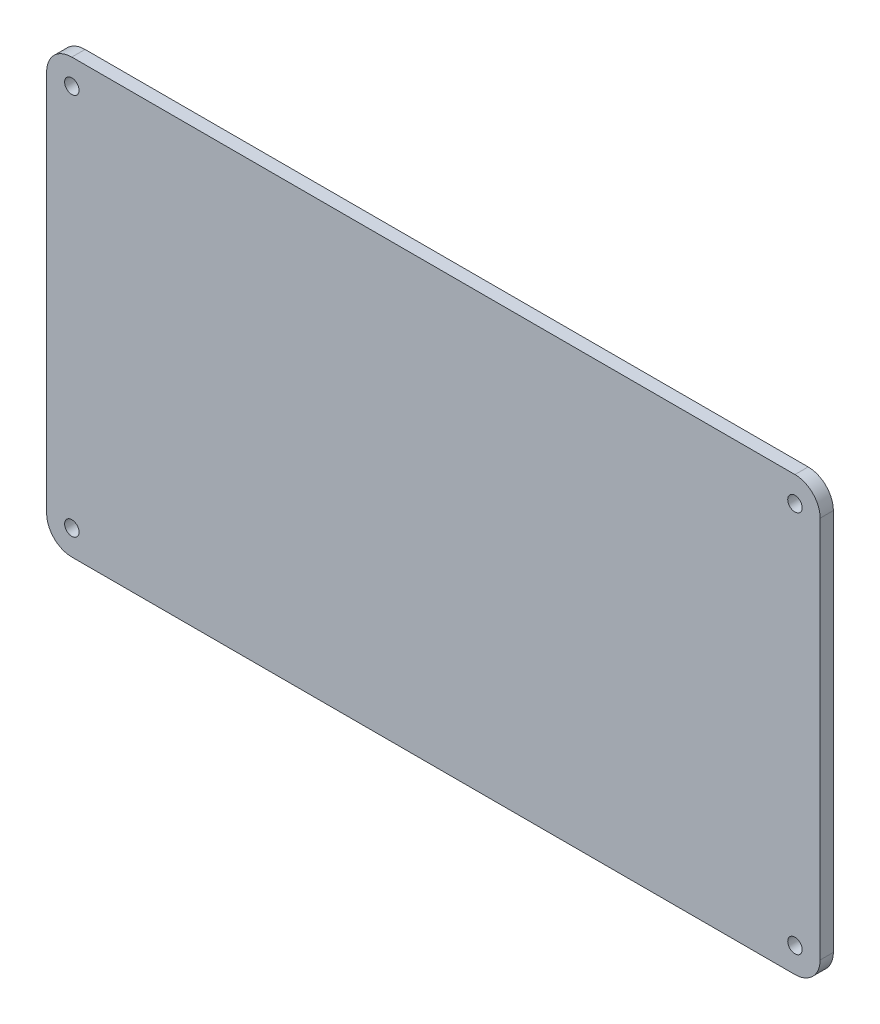
from build123d import *

# Parameters (mm, degrees)
SKETCH1_W           = 117
SKETCH1_H           = 65.5
BOSS_EXTRUDE1_DEPTH = 2
FILLET1_R           = 3.81
FILLET2_R           = 3.81
FILLET3_R           = 3.81
FILLET5_R           = 3.81
SKETCH3_R           = 1.0922
CUT_EXTRUDE1_DEPTH  = 68.073187639
SKETCH4_R           = 1.0922
CUT_EXTRUDE2_DEPTH  = 68.073187639
SKETCH5_R           = 1.0922
CUT_EXTRUDE3_DEPTH  = 68.073187639
SKETCH6_R           = 1.0922
CUT_EXTRUDE4_DEPTH  = 68.073187639
BOSS_EXTRUDE6_DEPTH = 1.5


with BuildPart() as part:
    # Sketch1 → Boss-Extrude1 (new body)
    with BuildSketch(Plane.XY):
        Rectangle(SKETCH1_W, SKETCH1_H)
    extrude(amount=BOSS_EXTRUDE1_DEPTH)

    # Fillet1
    fillet1_edges = [part.edges().sort_by_distance(p)[0] for p in [
        (-58.5, 32.75, 1),
    ]]
    fillet(fillet1_edges, radius=FILLET1_R)

    # Fillet2
    fillet2_edges = [part.edges().sort_by_distance(p)[0] for p in [
        (58.5, 32.75, 1),
    ]]
    fillet(fillet2_edges, radius=FILLET2_R)

    # Fillet3
    fillet3_edges = [part.edges().sort_by_distance(p)[0] for p in [
        (58.5, -32.75, 1),
    ]]
    fillet(fillet3_edges, radius=FILLET3_R)

    # Fillet5
    fillet5_edges = [part.edges().sort_by_distance(p)[0] for p in [
        (-58.5, -32.75, 1),
    ]]
    fillet(fillet5_edges, radius=FILLET5_R)

    # Sketch3 → Cut-Extrude1 (cut, through all)
    with BuildSketch(Plane(origin=(0, 0, 0), x_dir=(-1, 0, 0), z_dir=(0, 0, -1))):
        with Locations((-54.69, -28.94)):
            Circle(SKETCH3_R)
    extrude(amount=-CUT_EXTRUDE1_DEPTH, mode=Mode.SUBTRACT)

    # Sketch4 → Cut-Extrude2 (cut, through all)
    with BuildSketch(Plane(origin=(0, 0, 0), x_dir=(-1, 0, 0), z_dir=(0, 0, -1))):
        with Locations((-54.69, 28.94)):
            Circle(SKETCH4_R)
    extrude(amount=-CUT_EXTRUDE2_DEPTH, mode=Mode.SUBTRACT)

    # Sketch5 → Cut-Extrude3 (cut, through all)
    with BuildSketch(Plane(origin=(0, 0, 0), x_dir=(-1, 0, 0), z_dir=(0, 0, -1))):
        with Locations((54.69, 28.94)):
            Circle(SKETCH5_R)
    extrude(amount=-CUT_EXTRUDE3_DEPTH, mode=Mode.SUBTRACT)

    # Sketch6 → Cut-Extrude4 (cut, through all)
    with BuildSketch(Plane(origin=(0, 0, 0), x_dir=(-1, 0, 0), z_dir=(0, 0, -1))):
        with Locations((54.69, -28.94)):
            Circle(SKETCH6_R)
    extrude(amount=-CUT_EXTRUDE4_DEPTH, mode=Mode.SUBTRACT)

    # Sketch7 → Boss-Extrude6 (add)
    # profile 1 of 9: a face of its own
    with BuildSketch(Plane(origin=(0, 0, 0), x_dir=(-1, 0, 0), z_dir=(0, 0, -1))):
        with BuildLine():
            add(Edge.make_bspline(
                [(-34.076484638, -2.524380315), (-34.142297411, -2.518287412), (-34.278415246, -2.505685712), (-34.473327055, -2.405830639), (-34.658873176, -2.250211567), (-34.832693072, -2.032196345), (-35.00233108, -1.757885069), (-35.160700187, -1.422406656), (-35.319742836, -1.029714963), (-35.410203011, -0.743699801), (-35.458264394, -0.591740287)],
                knots=[0, 0, 0, 0, 0.627237053, 1.297288438, 2.052212286, 2.932790172, 3.95043259, 5.131943976, 6.476205259, 8, 8, 8, 8], degree=3))
            add(Edge.make_bspline(
                [(-35.458264394, -0.591740287), (-35.47863462, -0.526253159), (-35.522582482, -0.384967578), (-35.586335618, -0.155490175), (-35.657509821, 0.106048934), (-35.724109864, 0.403596304), (-35.802240701, 0.733050559), (-35.879352026, 1.096974405), (-35.964007588, 1.493101883), (-36.018037821, 1.7690017), (-36.046157289, 1.912590863)],
                knots=[0, 0, 0, 0, 0.639510794, 1.379716245, 2.220869674, 3.166734285, 4.222602057, 5.378338425, 6.635583759, 8, 8, 8, 8], degree=3))
            add(Edge.make_bspline(
                [(-36.046157289, 1.912590863), (-36.12104479, 1.902914378), (-36.276448806, 1.882834063), (-36.516880457, 1.844546284), (-36.774101522, 1.803896492), (-37.04764592, 1.754001056), (-37.33861179, 1.701348135), (-37.646381184, 1.643122447), (-37.970722988, 1.581372727), (-38.191796273, 1.53562955), (-38.30514731, 1.512175624)],
                knots=[0, 0, 0, 0, 0.789717044, 1.638794156, 2.54618316, 3.513317736, 4.546845654, 5.638853353, 6.78936787, 8, 8, 8, 8], degree=3))
            Line((-38.30514731, 1.512175624), (-40.557193714, 1.070098683))
            add(Edge.make_bspline(
                [(-40.557193714, 1.070098683), (-40.600034499, 0.97888552), (-40.690547603, 0.786172282), (-40.841749146, 0.484401652), (-41.016461854, 0.154792907), (-41.207566192, -0.207659542), (-41.423927624, -0.59782103), (-41.659408478, -1.019856147), (-41.91890273, -1.469405687), (-42.098615548, -1.77913518), (-42.191258216, -1.938801959)],
                knots=[0, 0, 0, 0, 0.706109762, 1.49185374, 2.364798038, 3.320085166, 4.362912815, 5.490803627, 6.70649934, 8, 8, 8, 8], degree=3))
            add(Edge.make_bspline(
                [(-42.191258216, -1.938801959), (-42.238906978, -2.005857008), (-42.330501237, -2.134755583), (-42.517758529, -2.274516561), (-42.729586298, -2.361331097), (-42.880146774, -2.37119205), (-42.957370611, -2.376249822)],
                knots=[0, 0, 0, 0, 1.065023514, 2.047273324, 2.998428726, 4, 4, 4, 4], degree=3))
            add(Edge.make_bspline(
                [(-42.957370611, -2.376249822), (-43.014797438, -2.37393682), (-43.128328337, -2.369364092), (-43.292070871, -2.321962667), (-43.44801008, -2.252607941), (-43.589544058, -2.154023833), (-43.709273075, -2.033724153), (-43.798046799, -1.8951805), (-43.854519588, -1.742416374), (-43.859725984, -1.634532464), (-43.862355342, -1.580048421)],
                knots=[0, 0, 0, 0, 1.029237579, 2.034767923, 3.039820331, 4.08582018, 5.115151118, 6.068889547, 7.024741471, 8, 8, 8, 8], degree=3))
            add(Edge.make_bspline(
                [(-43.862355342, -1.580048421), (-43.861353569, -1.561453261), (-43.859029842, -1.518319678), (-43.840136761, -1.446814968), (-43.81507555, -1.357745658), (-43.777549353, -1.253084261), (-43.730822519, -1.131027411), (-43.672550919, -0.993371593), (-43.605955894, -0.837708992), (-43.526576106, -0.667063215), (-43.438034203, -0.479098304), (-43.342353706, -0.273531678), (-43.232011416, -0.052842382), (-43.112106827, 0.184620479), (-42.982354774, 0.439152135), (-42.843766855, 0.710501587), (-42.693189811, 0.997452459), (-42.587972946, 1.193624559), (-42.533809982, 1.294608962)],
                knots=[0, 0, 0, 0, 0.280854559, 0.651473977, 1.112817739, 1.680786989, 2.330510135, 3.088530438, 3.939925421, 4.889632643, 5.933026198, 7.080696898, 8.316743064, 9.662310436, 11.101781582, 12.635170849, 14.267871613, 16, 16, 16, 16], degree=3))
            add(Edge.make_bspline(
                [(-42.533809982, 1.294608962), (-42.556418394, 1.329522524), (-42.601407992, 1.39899875), (-42.651199518, 1.514019373), (-42.678994114, 1.638148671), (-42.682482425, 1.723436032), (-42.684255014, 1.766774909)],
                knots=[0, 0, 0, 0, 0.989709652, 1.969472221, 2.968184824, 4, 4, 4, 4], degree=3))
            add(Edge.make_bspline(
                [(-42.684255014, 1.766774909), (-42.681536951, 1.817931453), (-42.676261202, 1.917226104), (-42.636764179, 2.05922468), (-42.566601954, 2.185479285), (-42.470653018, 2.298375898), (-42.344492808, 2.392822596), (-42.19449776, 2.474988539), (-42.016481329, 2.5380716), (-41.888361803, 2.569552942), (-41.820931984, 2.586121699)],
                knots=[0, 0, 0, 0, 0.941514007, 1.827474979, 2.685780788, 3.582610076, 4.534570273, 5.570886382, 6.721547768, 8, 8, 8, 8], degree=3))
            add(Edge.make_bspline(
                [(-41.820931984, 2.586121699), (-41.734829278, 2.726727226), (-41.558738961, 3.014282325), (-41.282866438, 3.451487037), (-40.991751423, 3.904723989), (-40.68356249, 4.373358729), (-40.356342168, 4.855487983), (-40.017528591, 5.356706412), (-39.657553903, 5.869960826), (-39.411642612, 6.216966236), (-39.286511827, 6.393538281)],
                knots=[0, 0, 0, 0, 0.864940526, 1.768906697, 2.711985905, 3.690872086, 4.711292238, 5.76878961, 6.864659255, 8, 8, 8, 8], degree=3))
            add(Edge.make_bspline(
                [(-39.286511827, 6.393538281), (-39.202553627, 6.511677239), (-39.03920818, 6.74152329), (-38.799142478, 7.074531968), (-38.570707672, 7.383892812), (-38.354199839, 7.669776732), (-38.151525287, 7.933680098), (-37.959242158, 8.173679359), (-37.781310673, 8.392157627), (-37.614907985, 8.586914727), (-37.459128372, 8.758405271), (-37.31761032, 8.908655293), (-37.186328058, 9.034454898), (-37.070298574, 9.139804887), (-36.962477952, 9.219360957), (-36.868713086, 9.277463965), (-36.78667759, 9.317194065), (-36.733876164, 9.323333122), (-36.710429969, 9.326059138)],
                knots=[0, 0, 0, 0, 1.763198122, 3.430402077, 4.994131284, 6.441445896, 7.793143865, 9.04203117, 10.18252256, 11.220925703, 12.157870356, 13.000982108, 13.731153385, 14.369531661, 14.90641748, 15.357135516, 15.714539415, 16, 16, 16, 16], degree=3))
            add(Edge.make_bspline(
                [(-36.710429969, 9.326059138), (-36.654632215, 9.323441581), (-36.546947022, 9.318389907), (-36.391904672, 9.277705469), (-36.251649687, 9.209570822), (-36.12385097, 9.115201198), (-36.012595293, 8.992331911), (-35.914582792, 8.844061875), (-35.831454387, 8.669244678), (-35.790051343, 8.541219428), (-35.768412614, 8.474308802)],
                knots=[0, 0, 0, 0, 0.972998157, 1.877808474, 2.775272714, 3.680283453, 4.63331862, 5.653007627, 6.773376903, 8, 8, 8, 8], degree=3))
            Line((-35.768412614, 8.474308802), (-35.22449596, 5.854250704))
            Line((-35.22449596, 5.854250704), (-33.939926839, 0.431285931))
            Line((-33.939926839, 0.431285931), (-33.446930042, -0.841710494))
            add(Edge.make_bspline(
                [(-33.446930042, -0.841710494), (-33.409830224, -0.940962949), (-33.342649785, -1.120689533), (-33.263713179, -1.365026187), (-33.211776502, -1.555657999), (-33.201291422, -1.66627793), (-33.196959835, -1.711977142)],
                knots=[0, 0, 0, 0, 1.399429325, 2.53408998, 3.394404491, 4, 4, 4, 4], degree=3))
            add(Edge.make_bspline(
                [(-33.196959835, -1.711977142), (-33.199780901, -1.767169238), (-33.205352883, -1.87618096), (-33.258654449, -2.031427407), (-33.3451137, -2.172400574), (-33.462211747, -2.294622774), (-33.599667087, -2.394426993), (-33.748514937, -2.472116728), (-33.909585442, -2.516807954), (-34.020676121, -2.521848234), (-34.076484638, -2.524380315)],
                knots=[0, 0, 0, 0, 0.995750111, 1.966738761, 2.93138726, 3.968063069, 5.006522448, 5.992738928, 6.991614194, 8, 8, 8, 8], degree=3))
        make_face()
        with BuildLine():
            Line((-37.122417903, 6.502321612), (-39.608232742, 2.93793162))
            add(Edge.make_bspline(
                [(-39.608232742, 2.93793162), (-39.514900006, 2.958083471), (-39.317592787, 3.000684876), (-39.004639286, 3.066198071), (-38.657073756, 3.132200559), (-38.275461918, 3.204760515), (-37.859464809, 3.278083327), (-37.409730594, 3.354869957), (-36.926475014, 3.432608764), (-36.593156496, 3.48645753), (-36.4211126, 3.51425182)],
                knots=[0, 0, 0, 0, 0.707441545, 1.495545197, 2.368845143, 3.32851185, 4.373551854, 5.498414299, 6.708794965, 8, 8, 8, 8], degree=3))
            Line((-36.4211126, 3.51425182), (-37.122417903, 6.502321612))
        make_face(mode=Mode.SUBTRACT)
    # profile 2 of 9: a face of its own
    with BuildSketch(Plane(origin=(0, 0, 0), x_dir=(-1, 0, 0), z_dir=(0, 0, -1))):
        with BuildLine():
            add(Edge.make_bspline(
                [(-26.18159226, 1.435795838), (-26.289576495, 1.426934772), (-26.524669633, 1.40764329), (-26.906628154, 1.384988067), (-27.346462203, 1.366838103), (-27.844164047, 1.353856238), (-28.399662157, 1.342403951), (-29.012242755, 1.332651505), (-29.682713959, 1.328902864), (-30.148712026, 1.327660449), (-30.39173862, 1.327012507)],
                knots=[0, 0, 0, 0, 0.617255089, 1.343829833, 2.179699265, 3.125082117, 4.180211414, 5.345129949, 6.615436257, 8, 8, 8, 8], degree=3))
            add(Edge.make_bspline(
                [(-30.39173862, 1.327012507), (-30.448977669, 1.328496265), (-30.556510011, 1.331283731), (-30.707032308, 1.359339459), (-30.836204612, 1.403608143), (-30.941735772, 1.470761074), (-31.026108201, 1.554895551), (-31.08166742, 1.661759872), (-31.117715365, 1.784509815), (-31.121264088, 1.872956393), (-31.12313293, 1.91953448)],
                knots=[0, 0, 0, 0, 1.276189757, 2.397518408, 3.405332155, 4.30345231, 5.16809448, 6.031191879, 6.963178496, 8, 8, 8, 8], degree=3))
            add(Edge.make_bspline(
                [(-31.12313293, 1.91953448), (-31.121264088, 1.966112566), (-31.117715365, 2.054559145), (-31.08166742, 2.177309088), (-31.026108201, 2.284173408), (-30.941735772, 2.368307886), (-30.836204612, 2.435460816), (-30.707032308, 2.479729501), (-30.556510011, 2.507785229), (-30.448977669, 2.510572695), (-30.39173862, 2.512056452)],
                knots=[0, 0, 0, 0, 1.036821504, 1.968808121, 2.83190552, 3.69654769, 4.594667845, 5.602481592, 6.723810243, 8, 8, 8, 8], degree=3))
            add(Edge.make_bspline(
                [(-30.39173862, 2.512056452), (-30.330791142, 2.512929972), (-30.201953858, 2.514776511), (-29.997437914, 2.515536806), (-29.772241979, 2.524637018), (-29.525235566, 2.529454918), (-29.25689461, 2.543427458), (-28.966631624, 2.552570549), (-28.655129961, 2.571292959), (-28.329382913, 2.584904709), (-28.004033195, 2.605659395), (-27.692160345, 2.617317262), (-27.402232015, 2.633486457), (-27.133597782, 2.640461741), (-26.887606375, 2.652162648), (-26.662997405, 2.654607564), (-26.459369238, 2.661365529), (-26.330499009, 2.660565399), (-26.26954474, 2.660186946)],
                knots=[0, 0, 0, 0, 0.709234172, 1.499254891, 2.379406002, 3.331341451, 4.37363206, 5.505615279, 6.710163896, 8.004368035, 9.299039087, 10.50315277, 11.635527464, 12.677470094, 13.629701787, 14.500648932, 15.290822642, 16, 16, 16, 16], degree=3))
            add(Edge.make_bspline(
                [(-26.26954474, 2.660186946), (-26.208499408, 2.658591205), (-26.094165085, 2.655602477), (-25.934372939, 2.629274059), (-25.799328346, 2.580403344), (-25.687484039, 2.512694279), (-25.598567488, 2.425452413), (-25.537110721, 2.316388186), (-25.499249202, 2.188954285), (-25.495920908, 2.097266973), (-25.49417419, 2.049148661)],
                knots=[0, 0, 0, 0, 1.29955601, 2.433992136, 3.43197965, 4.339302491, 5.198966306, 6.052801824, 6.978093199, 8, 8, 8, 8], degree=3))
            add(Edge.make_bspline(
                [(-25.49417419, 2.049148661), (-25.496347454, 2.006479655), (-25.500526106, 1.924437643), (-25.533882918, 1.808535422), (-25.58727066, 1.706681605), (-25.664497321, 1.620374627), (-25.764110227, 1.551211063), (-25.883697268, 1.495343238), (-26.025403978, 1.456492983), (-26.127361789, 1.442982138), (-26.18159226, 1.435795838)],
                knots=[0, 0, 0, 0, 0.994364514, 1.911918598, 2.789932966, 3.657173744, 4.586488446, 5.601344169, 6.72417588, 8, 8, 8, 8], degree=3))
        make_face()
    # profile 3 of 9: a face of its own
    with BuildSketch(Plane(origin=(0, 0, 0), x_dir=(-1, 0, 0), z_dir=(0, 0, -1))):
        with BuildLine():
            add(Edge.make_bspline(
                [(-13.021123758, 7.673478324), (-13.076674727, 7.674130252), (-13.195504791, 7.675524805), (-13.384532039, 7.680355638), (-13.594382195, 7.687429755), (-13.825904291, 7.696230915), (-14.078124017, 7.710836618), (-14.352017416, 7.72692051), (-14.646728782, 7.74558471), (-14.850384533, 7.75906424), (-14.956078325, 7.766059882)],
                knots=[0, 0, 0, 0, 0.688173031, 1.47208313, 2.342245972, 3.289164608, 4.342001398, 5.471714324, 6.687863714, 8, 8, 8, 8], degree=3))
            add(Edge.make_bspline(
                [(-14.956078325, 7.766059882), (-15.058669875, 7.773320788), (-15.258381184, 7.787455334), (-15.548579293, 7.802735523), (-15.819366078, 7.816941336), (-16.070885703, 7.828380982), (-16.303070298, 7.838534264), (-16.516836252, 7.842485784), (-16.711262971, 7.845239232), (-16.834711541, 7.844910397), (-16.893347431, 7.844754206)],
                knots=[0, 0, 0, 0, 1.272783684, 2.477682578, 3.596262609, 4.628547485, 5.593648077, 6.472268533, 7.274354548, 8, 8, 8, 8], degree=3))
            Line((-16.893347431, 7.844754206), (-17.495127559, 7.844754206))
            add(Edge.make_bspline(
                [(-17.495127559, 7.844754206), (-17.493247462, 7.748300693), (-17.489215259, 7.541439069), (-17.473125134, 7.2098117), (-17.458331419, 6.836305549), (-17.436542627, 6.420497571), (-17.41226143, 5.963637884), (-17.37780921, 5.46468817), (-17.344423977, 4.923722174), (-17.318683626, 4.54883565), (-17.305335365, 4.354429461)],
                knots=[0, 0, 0, 0, 0.662287626, 1.420392993, 2.279271348, 3.228591885, 4.278970697, 5.420189275, 6.662178718, 8, 8, 8, 8], degree=3))
            add(Edge.make_bspline(
                [(-17.305335365, 4.354429461), (-17.292488446, 4.172383643), (-17.267509516, 3.818422549), (-17.239415651, 3.30206243), (-17.209470762, 2.817744507), (-17.190587318, 2.364688892), (-17.169998147, 1.943579181), (-17.159429602, 1.553104956), (-17.151740172, 1.194343175), (-17.150738407, 0.965948144), (-17.150261255, 0.857161099)],
                knots=[0, 0, 0, 0, 1.250920863, 2.432230094, 3.544599973, 4.576930357, 5.540343505, 6.434469504, 7.254320742, 8, 8, 8, 8], degree=3))
            add(Edge.make_bspline(
                [(-17.150261255, 0.857161099), (-17.149855187, 0.805459824), (-17.148957658, 0.691184824), (-17.138597762, 0.502112932), (-17.121661763, 0.278474693), (-17.102505832, 0.030732864), (-17.078447157, -0.216591399), (-17.062393831, -0.441920807), (-17.052049762, -0.633302264), (-17.051143819, -0.749890413), (-17.05073608, -0.802363332)],
                knots=[0, 0, 0, 0, 0.746059977, 1.649011621, 2.731816557, 3.982842355, 5.234809165, 6.317614101, 7.242807261, 8, 8, 8, 8], degree=3))
            add(Edge.make_bspline(
                [(-17.05073608, -0.802363332), (-17.052743517, -0.88738427), (-17.056648516, -1.052772519), (-17.092837772, -1.290519931), (-17.1455559, -1.512712889), (-17.204575738, -1.647863582), (-17.233584657, -1.714291681)],
                knots=[0, 0, 0, 0, 1.087563333, 2.115598803, 3.073795441, 4, 4, 4, 4], degree=3))
            add(Edge.make_bspline(
                [(-17.233584657, -1.714291681), (-17.253535817, -1.754894916), (-17.29190293, -1.832977039), (-17.361809031, -1.938585873), (-17.44082948, -2.028178452), (-17.530290653, -2.099680313), (-17.624738228, -2.159629225), (-17.729817564, -2.19811356), (-17.841635761, -2.225808446), (-17.920045422, -2.227334764), (-17.960349889, -2.228119329)],
                knots=[0, 0, 0, 0, 1.145412748, 2.20268795, 3.199496569, 4.158196401, 5.096956803, 6.019082486, 6.981760342, 8, 8, 8, 8], degree=3))
            add(Edge.make_bspline(
                [(-17.960349889, -2.228119329), (-18.014638533, -2.225529253), (-18.122535145, -2.220381577), (-18.279008486, -2.17651374), (-18.427643547, -2.108138465), (-18.564770591, -2.015389841), (-18.681247561, -1.898232817), (-18.765898848, -1.761232294), (-18.82053418, -1.608708712), (-18.825667571, -1.501053303), (-18.828301998, -1.445805162)],
                knots=[0, 0, 0, 0, 1.003017428, 1.993458941, 2.983591728, 4.021069946, 5.040713941, 6.015285789, 6.981456, 8, 8, 8, 8], degree=3))
            add(Edge.make_bspline(
                [(-18.828301998, -1.445805162), (-18.825087547, -1.397128284), (-18.817348567, -1.279935838), (-18.787222132, -1.095331435), (-18.753129757, -0.911330557), (-18.745719212, -0.793201204), (-18.742664056, -0.744499858)],
                knots=[0, 0, 0, 0, 0.827618306, 1.992539752, 3.172381694, 4, 4, 4, 4], degree=3))
            add(Edge.make_bspline(
                [(-18.742664056, -0.744499858), (-18.742875891, -0.672733807), (-18.743347628, -0.512916983), (-18.757888498, -0.249166985), (-18.771654426, 0.062753999), (-18.799485576, 0.405695169), (-18.819993257, 0.749131493), (-18.840803448, 1.061417333), (-18.849216065, 1.326973147), (-18.852351861, 1.488256924), (-18.853761926, 1.560780942)],
                knots=[0, 0, 0, 0, 0.746030391, 1.661345509, 2.745685004, 3.992124104, 5.238021067, 6.322805504, 7.245820717, 8, 8, 8, 8], degree=3))
            add(Edge.make_bspline(
                [(-18.853761926, 1.560780942), (-18.854110063, 1.658769091), (-18.854839378, 1.864045184), (-18.864724107, 2.185824492), (-18.881611496, 2.536049829), (-18.902674909, 2.914854263), (-18.926748012, 3.322442551), (-18.963344745, 3.757344829), (-19.002267978, 4.221057969), (-19.031031562, 4.539607624), (-19.04586866, 4.703924843)],
                knots=[0, 0, 0, 0, 0.746545009, 1.563942615, 2.452492704, 3.417955713, 4.454524338, 5.563123741, 6.74298803, 8, 8, 8, 8], degree=3))
            add(Edge.make_bspline(
                [(-19.04586866, 4.703924843), (-19.062386741, 4.879801827), (-19.09418215, 5.218344818), (-19.135015808, 5.7076273), (-19.173068058, 6.158054064), (-19.202532152, 6.570158926), (-19.228108355, 6.943563227), (-19.249803602, 7.278321297), (-19.263456586, 7.574662573), (-19.269764544, 7.759110626), (-19.272693477, 7.844754206)],
                knots=[0, 0, 0, 0, 1.346132914, 2.591151223, 3.741449212, 4.790735251, 5.739494213, 6.593619718, 7.346984476, 8, 8, 8, 8], degree=3))
            Line((-19.272693477, 7.844754206), (-20.057322183, 7.837810589))
            add(Edge.make_bspline(
                [(-20.057322183, 7.837810589), (-20.21009089, 7.838795293), (-20.507185355, 7.840710279), (-20.940826891, 7.852755806), (-21.349169608, 7.869863658), (-21.732637696, 7.898390488), (-22.090024146, 7.932432849), (-22.42288943, 7.973586032), (-22.730228366, 8.02378316), (-22.925948202, 8.065455415), (-23.019932046, 8.085466258)],
                knots=[0, 0, 0, 0, 1.230938798, 2.393848274, 3.495300147, 4.523739249, 5.491805293, 6.38778614, 7.225821665, 8, 8, 8, 8], degree=3))
            add(Edge.make_bspline(
                [(-23.019932046, 8.085466258), (-23.07521528, 8.100155609), (-23.180307066, 8.128079629), (-23.322524628, 8.191358748), (-23.444597199, 8.266265407), (-23.545119821, 8.356578044), (-23.623673771, 8.46276011), (-23.676472348, 8.583211905), (-23.710463842, 8.716262998), (-23.714499229, 8.809692531), (-23.716608272, 8.858522269)],
                knots=[0, 0, 0, 0, 1.204695245, 2.290089918, 3.269719037, 4.214263988, 5.12222455, 6.032514712, 6.971719238, 8, 8, 8, 8], degree=3))
            add(Edge.make_bspline(
                [(-23.716608272, 8.858522269), (-23.714038238, 8.910514465), (-23.708964921, 9.013148481), (-23.665488905, 9.161006849), (-23.595164979, 9.299032825), (-23.528513638, 9.378157702), (-23.494412532, 9.418640696)],
                knots=[0, 0, 0, 0, 1.009656831, 1.993090201, 2.973196305, 4, 4, 4, 4], degree=3))
            add(Edge.make_bspline(
                [(-23.494412532, 9.418640696), (-23.449900095, 9.460415371), (-23.362157052, 9.542761729), (-23.199617555, 9.623750543), (-23.021054947, 9.670412831), (-22.89678912, 9.66922557), (-22.832454391, 9.668610903)],
                knots=[0, 0, 0, 0, 0.997899837, 1.967062996, 2.94751072, 4, 4, 4, 4], degree=3))
            add(Edge.make_bspline(
                [(-22.832454391, 9.668610903), (-22.803897767, 9.667232832), (-22.738220492, 9.664063411), (-22.627125272, 9.654249249), (-22.491460443, 9.639932474), (-22.331751675, 9.623773557), (-22.147993883, 9.605784186), (-21.940632532, 9.581770134), (-21.708234427, 9.557079715), (-21.545548661, 9.537649483), (-21.45993279, 9.527424027)],
                knots=[0, 0, 0, 0, 0.497203655, 1.143516872, 1.939282595, 2.869900882, 3.935371774, 5.150454846, 6.500383316, 8, 8, 8, 8], degree=3))
            add(Edge.make_bspline(
                [(-21.45993279, 9.527424027), (-21.324176654, 9.514018499), (-21.065937989, 9.488518175), (-20.698846001, 9.456781175), (-20.371466963, 9.440730717), (-20.16688878, 9.436718804), (-20.071209417, 9.434842469)],
                knots=[0, 0, 0, 0, 1.175737947, 2.236517676, 3.175235292, 4, 4, 4, 4], degree=3))
            add(Edge.make_bspline(
                [(-20.071209417, 9.434842469), (-19.974771289, 9.435711933), (-19.75875122, 9.43765952), (-19.40227794, 9.438440282), (-18.978764736, 9.447662429), (-18.51118298, 9.452483892), (-18.042912576, 9.462324419), (-17.618595844, 9.470381469), (-17.261355182, 9.471410248), (-17.045334685, 9.473331793), (-16.948896366, 9.474189631)],
                knots=[0, 0, 0, 0, 0.741246133, 1.660381054, 2.739747494, 3.996986569, 5.254323528, 6.339618946, 7.258753867, 8, 8, 8, 8], degree=3))
            add(Edge.make_bspline(
                [(-16.948896366, 9.474189631), (-16.890263261, 9.473325173), (-16.766826164, 9.471505277), (-16.571569973, 9.470581544), (-16.357130403, 9.462211345), (-16.122495492, 9.454172278), (-15.868069609, 9.438247069), (-15.593216721, 9.426391462), (-15.298612583, 9.406516736), (-14.990794012, 9.386281888), (-14.68222121, 9.365733391), (-14.38680994, 9.346530818), (-14.111306299, 9.333018732), (-13.855862329, 9.322236535), (-13.620679102, 9.30938345), (-13.405384282, 9.302101545), (-13.210139595, 9.300924598), (-13.086701129, 9.299134821), (-13.028067375, 9.29828467)],
                knots=[0, 0, 0, 0, 0.717043492, 1.509552803, 2.38736802, 3.340945556, 4.380224428, 5.504292483, 6.704780896, 7.990606606, 9.276432315, 10.486336178, 11.610404233, 12.649212001, 13.61263198, 14.490447197, 15.282956508, 16, 16, 16, 16], degree=3))
            add(Edge.make_bspline(
                [(-13.028067375, 9.29828467), (-12.969156782, 9.295924371), (-12.854197593, 9.29131844), (-12.689280067, 9.246295413), (-12.54084482, 9.169982243), (-12.408706463, 9.068881488), (-12.301315339, 8.944555143), (-12.218254603, 8.804473516), (-12.172113879, 8.646857557), (-12.165694203, 8.537076139), (-12.162429805, 8.481252419)],
                knots=[0, 0, 0, 0, 1.063672944, 2.075670494, 3.061555116, 4.066216455, 5.065047989, 6.015136043, 6.990699061, 8, 8, 8, 8], degree=3))
            add(Edge.make_bspline(
                [(-12.162429805, 8.481252419), (-12.165467132, 8.426091542), (-12.171399726, 8.31834975), (-12.220587129, 8.164209852), (-12.296856819, 8.022176799), (-12.407547791, 7.901764219), (-12.535602825, 7.798088434), (-12.684833972, 7.726690089), (-12.847803801, 7.679929631), (-12.962146621, 7.675673568), (-13.021123758, 7.673478324)],
                knots=[0, 0, 0, 0, 1.005021331, 1.963036216, 2.927656754, 3.925544563, 4.928787268, 5.917886462, 6.926062046, 8, 8, 8, 8], degree=3))
        make_face()
    # profile 4 of 9: a face of its own
    with BuildSketch(Plane(origin=(0, 0, 0), x_dir=(-1, 0, 0), z_dir=(0, 0, -1))):
        with BuildLine():
            add(Edge.make_bspline(
                [(-7.537980972, -2.524380315), (-7.696246908, -2.521889741), (-8.006402243, -2.517008937), (-8.459278738, -2.473735949), (-8.89067987, -2.408697231), (-9.297285956, -2.310770314), (-9.682469903, -2.188461973), (-10.042978285, -2.037726755), (-10.383580632, -1.862695779), (-10.591451605, -1.72038384), (-10.695012107, -1.64948459)],
                knots=[0, 0, 0, 0, 1.140437731, 2.234927203, 3.276224868, 4.282394298, 5.246086552, 6.185849861, 7.09619752, 8, 8, 8, 8], degree=3))
            add(Edge.make_bspline(
                [(-10.695012107, -1.64948459), (-10.800706219, -1.567223279), (-11.007729933, -1.406097537), (-11.274648972, -1.123365217), (-11.50601027, -0.821238555), (-11.689431565, -0.490017318), (-11.839036328, -0.137989808), (-11.938082601, 0.240282829), (-12.003463175, 0.641181027), (-12.010626359, 0.917065204), (-12.014299312, 1.058525988)],
                knots=[0, 0, 0, 0, 1.024193336, 2.006093874, 2.967865734, 3.930725612, 4.897311701, 5.889026625, 6.917589428, 8, 8, 8, 8], degree=3))
            add(Edge.make_bspline(
                [(-12.014299312, 1.058525988), (-12.011496319, 1.22299714), (-12.005994661, 1.545817821), (-11.953532173, 2.020202219), (-11.868912106, 2.474763006), (-11.748484716, 2.908329698), (-11.594550286, 3.320804843), (-11.40914642, 3.714417774), (-11.188123162, 4.087928802), (-11.013587036, 4.318188105), (-10.926466003, 4.433123786)],
                knots=[0, 0, 0, 0, 1.091494512, 2.142363561, 3.163931453, 4.158014474, 5.125513205, 6.083147027, 7.043188275, 8, 8, 8, 8], degree=3))
            add(Edge.make_bspline(
                [(-10.926466003, 4.433123786), (-10.826345102, 4.551163823), (-10.629000183, 4.783828545), (-10.293744563, 5.088478511), (-9.931827948, 5.343992273), (-9.548182935, 5.55781291), (-9.136886429, 5.719973585), (-8.701179762, 5.835409344), (-8.240841125, 5.906421486), (-7.925537481, 5.914791189), (-7.76480579, 5.919057795)],
                knots=[0, 0, 0, 0, 1.024699187, 2.019749883, 2.99125864, 3.954408057, 4.922562849, 5.911978652, 6.935593643, 8, 8, 8, 8], degree=3))
            add(Edge.make_bspline(
                [(-7.76480579, 5.919057795), (-7.648270159, 5.917844302), (-7.420406335, 5.915471542), (-7.086906994, 5.893474331), (-6.76936637, 5.862063153), (-6.467641958, 5.816822031), (-6.182951617, 5.753376603), (-5.914772421, 5.679748272), (-5.661437871, 5.595404384), (-5.502962366, 5.523844688), (-5.424806905, 5.488553549)],
                knots=[0, 0, 0, 0, 1.166182522, 2.280253745, 3.343613719, 4.359223646, 5.331585901, 6.260740897, 7.142248541, 8, 8, 8, 8], degree=3))
            add(Edge.make_bspline(
                [(-5.424806905, 5.488553549), (-5.33630124, 5.443766672), (-5.165751792, 5.357462849), (-4.9386794, 5.194727147), (-4.74527085, 5.016417775), (-4.583288675, 4.82042992), (-4.464462412, 4.602236483), (-4.372818241, 4.369767803), (-4.322985594, 4.117346926), (-4.315394423, 3.943409349), (-4.311513668, 3.854489047)],
                knots=[0, 0, 0, 0, 1.132854472, 2.182998146, 3.181787557, 4.135209662, 5.075190747, 6.010690173, 6.983025774, 8, 8, 8, 8], degree=3))
            add(Edge.make_bspline(
                [(-4.311513668, 3.854489047), (-4.315096169, 3.791019619), (-4.322300362, 3.663386425), (-4.366535174, 3.474202869), (-4.445945373, 3.291209347), (-4.553183129, 3.112146889), (-4.691571981, 2.937892586), (-4.859859558, 2.76884764), (-5.05745333, 2.603766043), (-5.204750151, 2.503822575), (-5.28130549, 2.45187844)],
                knots=[0, 0, 0, 0, 0.856772834, 1.722918522, 2.604628115, 3.538394368, 4.531828262, 5.599255996, 6.752248889, 8, 8, 8, 8], degree=3))
            add(Edge.make_bspline(
                [(-5.28130549, 2.45187844), (-5.322094117, 2.4285551), (-5.412916912, 2.37662173), (-5.56493968, 2.295473742), (-5.749393622, 2.209149624), (-5.960985198, 2.108183836), (-6.205064646, 2.00420896), (-6.475595309, 1.883474467), (-6.779648303, 1.760739542), (-6.991802404, 1.673542867), (-7.102847648, 1.627902571)],
                knots=[0, 0, 0, 0, 0.563640651, 1.25504149, 2.066368299, 3.006235296, 4.067168639, 5.248398544, 6.559762675, 8, 8, 8, 8], degree=3))
            Line((-7.102847648, 1.627902571), (-10.384863887, 0.297042672))
            add(Edge.make_bspline(
                [(-10.384863887, 0.297042672), (-10.30273494, 0.190487513), (-10.140543745, -0.01994144), (-9.850988987, -0.291783244), (-9.535140828, -0.524815924), (-9.189563231, -0.717097056), (-8.81195521, -0.862438791), (-8.406918136, -0.968631898), (-7.971247604, -1.032044202), (-7.67166826, -1.039321745), (-7.517150121, -1.043075384)],
                knots=[0, 0, 0, 0, 0.978395114, 1.932169794, 2.88060097, 3.831226284, 4.802578707, 5.819201495, 6.875179703, 8, 8, 8, 8], degree=3))
            add(Edge.make_bspline(
                [(-7.517150121, -1.043075384), (-7.413653269, -1.040056485), (-7.198275652, -1.033774139), (-6.862930565, -0.991127704), (-6.501963571, -0.92700321), (-6.254643897, -0.866309377), (-6.126112209, -0.834766878)],
                knots=[0, 0, 0, 0, 0.880838772, 1.833031157, 2.873829326, 4, 4, 4, 4], degree=3))
            add(Edge.make_bspline(
                [(-6.126112209, -0.834766878), (-6.045645479, -0.812370509), (-5.890656133, -0.769232203), (-5.671283517, -0.69515425), (-5.473028947, -0.61799798), (-5.299748344, -0.530732345), (-5.144855687, -0.444847051), (-5.015133468, -0.349246859), (-4.905759075, -0.250594573), (-4.801574023, -0.111782797), (-4.685465432, 0.042433411), (-4.532706052, 0.185415923), (-4.36642451, 0.271650583), (-4.251400608, 0.28408637), (-4.19578672, 0.290099055)],
                knots=[0, 0, 0, 0, 1.310505532, 2.52420343, 3.632604911, 4.645144449, 5.567212923, 6.407518992, 7.169897725, 7.867621649, 9.125038815, 10.196864352, 11.128186565, 12, 12, 12, 12], degree=3))
            add(Edge.make_bspline(
                [(-4.19578672, 0.290099055), (-4.146931406, 0.287271323), (-4.049933493, 0.281657111), (-3.908691518, 0.241231441), (-3.776342212, 0.171974411), (-3.657194681, 0.078094631), (-3.552779212, -0.030113701), (-3.476758372, -0.152963293), (-3.430134892, -0.285265226), (-3.425201115, -0.37689749), (-3.422730709, -0.422778943)],
                knots=[0, 0, 0, 0, 1.010519731, 2.00629769, 3.013278822, 4.083236768, 5.133836608, 6.108784691, 7.053044171, 8, 8, 8, 8], degree=3))
            add(Edge.make_bspline(
                [(-3.422730709, -0.422778943), (-3.426728778, -0.497530486), (-3.434761657, -0.64772048), (-3.516006981, -0.865011983), (-3.63772605, -1.074177115), (-3.811815238, -1.272256165), (-4.032098454, -1.461243373), (-4.298433356, -1.645180291), (-4.614750231, -1.817041488), (-4.845390017, -1.919635125), (-4.966528192, -1.973520044)],
                knots=[0, 0, 0, 0, 0.772457818, 1.552013912, 2.376957977, 3.273666083, 4.271974722, 5.381989359, 6.624950889, 8, 8, 8, 8], degree=3))
            add(Edge.make_bspline(
                [(-4.966528192, -1.973520044), (-5.183372919, -2.058271534), (-5.608510244, -2.224432005), (-6.260138947, -2.392519118), (-6.901504122, -2.503947891), (-7.327682789, -2.517629242), (-7.537980972, -2.524380315)],
                knots=[0, 0, 0, 0, 1.054971807, 2.068336629, 3.046819261, 4, 4, 4, 4], degree=3))
        make_face()
        with BuildLine():
            add(Edge.make_bspline(
                [(-7.730087705, 4.437752864), (-7.816610634, 4.435506257), (-7.985650283, 4.431117066), (-8.233465989, 4.397379737), (-8.471028437, 4.344994265), (-8.697410977, 4.268523518), (-8.913209524, 4.170343469), (-9.116873329, 4.049525109), (-9.309784414, 3.907524979), (-9.491772312, 3.744532564), (-9.660416665, 3.558330532), (-9.818624456, 3.350510129), (-9.966272498, 3.121392372), (-10.103337932, 2.870073934), (-10.227678452, 2.596688331), (-10.340642229, 2.301021426), (-10.445458783, 1.984667983), (-10.503347185, 1.764040828), (-10.532994381, 1.651047961)],
                knots=[0, 0, 0, 0, 0.963939429, 1.883246265, 2.782265649, 3.671362691, 4.540913055, 5.419765497, 6.305405192, 7.206518999, 8.137690927, 9.100709614, 10.114293997, 11.172411798, 12.288170867, 13.458578354, 14.698426228, 16, 16, 16, 16], degree=3))
            Line((-10.532994381, 1.651047961), (-7.875903659, 2.724994036))
            add(Edge.make_bspline(
                [(-7.875903659, 2.724994036), (-7.750053969, 2.778004266), (-7.507035244, 2.880368271), (-7.157364325, 3.031913606), (-6.836949881, 3.181357362), (-6.543445433, 3.32287392), (-6.279247156, 3.463488711), (-6.040752335, 3.593440352), (-5.83114008, 3.720512178), (-5.704477599, 3.808382056), (-5.644688106, 3.849859969)],
                knots=[0, 0, 0, 0, 1.309235869, 2.528165385, 3.653338574, 4.698682857, 5.651565488, 6.522304446, 7.302471682, 8, 8, 8, 8], degree=3))
            add(Edge.make_bspline(
                [(-5.644688106, 3.849859969), (-5.708339811, 3.897932072), (-5.837393241, 3.995397956), (-6.055499074, 4.110306514), (-6.28811725, 4.214327438), (-6.540235142, 4.296894915), (-6.811691487, 4.358545458), (-7.100779068, 4.404779698), (-7.409359844, 4.432772328), (-7.621245125, 4.436062663), (-7.730087705, 4.437752864)],
                knots=[0, 0, 0, 0, 0.865983463, 1.75577599, 2.672295888, 3.635283645, 4.634425525, 5.696393724, 6.816668861, 8, 8, 8, 8], degree=3))
        make_face(mode=Mode.SUBTRACT)
    # profile 5 of 9: a face of its own
    with BuildSketch(Plane(origin=(0, 0, 0), x_dir=(-1, 0, 0), z_dir=(0, 0, -1))):
        with BuildLine():
            add(Edge.make_bspline(
                [(6.564504885, 6.511579768), (6.521150456, 6.513275239), (6.436585291, 6.516582347), (6.313393337, 6.545098171), (6.199278972, 6.594187157), (6.093611868, 6.663046678), (5.995732297, 6.749222504), (5.907530431, 6.854906591), (5.82786129, 6.979560228), (5.784225199, 7.071911438), (5.761359868, 7.120303513)],
                knots=[0, 0, 0, 0, 0.968995114, 1.890077496, 2.810189125, 3.734177646, 4.700247833, 5.716802253, 6.803603376, 8, 8, 8, 8], degree=3))
            add(Edge.make_bspline(
                [(5.761359868, 7.120303513), (5.722638213, 7.199818188), (5.652475814, 7.343896235), (5.538097041, 7.529248755), (5.431886593, 7.670390052), (5.346924677, 7.729022474), (5.310024771, 7.754487187)],
                knots=[0, 0, 0, 0, 1.344807209, 2.436747631, 3.321062104, 4, 4, 4, 4], degree=3))
            add(Edge.make_bspline(
                [(5.310024771, 7.754487187), (5.268685449, 7.768949366), (5.166830925, 7.804582228), (4.972386873, 7.824638044), (4.714150467, 7.84486119), (4.518557515, 7.844792466), (4.409669117, 7.844754206)],
                knots=[0, 0, 0, 0, 0.576525331, 1.420480778, 2.563957892, 4, 4, 4, 4], degree=3))
            add(Edge.make_bspline(
                [(4.409669117, 7.844754206), (4.302713744, 7.839026459), (4.083584754, 7.827291512), (3.753372221, 7.740178102), (3.415760551, 7.604099945), (3.069236959, 7.413695673), (2.714624766, 7.168937054), (2.355110494, 6.867001278), (1.982233764, 6.5170783), (1.743073063, 6.254867963), (1.618335137, 6.118108145)],
                knots=[0, 0, 0, 0, 0.760375785, 1.557849524, 2.4151053, 3.346048028, 4.364656211, 5.475833875, 6.683482498, 8, 8, 8, 8], degree=3))
            add(Edge.make_bspline(
                [(1.618335137, 6.118108145), (1.453996892, 5.927911442), (1.13537595, 5.559155813), (0.710090087, 4.991586965), (0.35104476, 4.430209644), (0.057732158, 3.875090721), (-0.174871549, 3.328638721), (-0.337785714, 2.787784082), (-0.440776245, 2.254444065), (-0.453732704, 1.899913436), (-0.460120845, 1.725113207)],
                knots=[0, 0, 0, 0, 1.214247271, 2.35419704, 3.423484661, 4.430647988, 5.384669355, 6.288017616, 7.155912387, 8, 8, 8, 8], degree=3))
            add(Edge.make_bspline(
                [(-0.460120845, 1.725113207), (-0.457727229, 1.643234808), (-0.45298896, 1.481152922), (-0.420397445, 1.242183222), (-0.364773837, 1.011793306), (-0.285904347, 0.790492218), (-0.182333442, 0.579034529), (-0.059922953, 0.37429471), (0.086391834, 0.179181512), (0.198383509, 0.059199762), (0.255071692, -0.001532853)],
                knots=[0, 0, 0, 0, 1.023723826, 2.026506259, 3.009227267, 3.982623252, 4.957738682, 5.948758412, 6.961698201, 8, 8, 8, 8], degree=3))
            add(Edge.make_bspline(
                [(0.255071692, -0.001532853), (0.31657563, -0.060505728), (0.438037322, -0.176968924), (0.634907959, -0.330114505), (0.842808483, -0.459150456), (1.061110518, -0.561862309), (1.286925596, -0.648125925), (1.523588626, -0.704042904), (1.769176911, -0.740651311), (1.936060717, -0.744734551), (2.021064915, -0.746814397)],
                knots=[0, 0, 0, 0, 1.037126596, 2.048180278, 3.031124573, 4.010244955, 4.982308196, 5.968972129, 6.965472456, 8, 8, 8, 8], degree=3))
            add(Edge.make_bspline(
                [(2.021064915, -0.746814397), (2.16955448, -0.74197501), (2.46846425, -0.732233315), (2.915490797, -0.650157332), (3.365598757, -0.528464465), (3.655624794, -0.404747219), (3.803259911, -0.34177008)],
                knots=[0, 0, 0, 0, 0.96721383, 1.947003241, 2.954940669, 4, 4, 4, 4], degree=3))
            add(Edge.make_bspline(
                [(3.803259911, -0.34177008), (3.848221963, -0.320590606), (3.943776861, -0.275579262), (4.091855389, -0.194482409), (4.25989271, -0.105201092), (4.443259927, 0.001100488), (4.642867676, 0.12187227), (4.857649174, 0.257352365), (5.092555335, 0.401701965), (5.252429541, 0.506471833), (5.3354847, 0.560900113)],
                knots=[0, 0, 0, 0, 0.670114203, 1.424149728, 2.27612863, 3.236296734, 4.281955869, 5.422350562, 6.66090293, 8, 8, 8, 8], degree=3))
            add(Edge.make_bspline(
                [(5.3354847, 0.560900113), (5.411836616, 0.609416251), (5.550861537, 0.697756566), (5.75188658, 0.798804963), (5.922416545, 0.865502919), (6.029453047, 0.877422351), (6.076137165, 0.882621028)],
                knots=[0, 0, 0, 0, 1.329612077, 2.421016042, 3.311323953, 4, 4, 4, 4], degree=3))
            add(Edge.make_bspline(
                [(6.076137165, 0.882621028), (6.135840142, 0.879504965), (6.251758604, 0.87345486), (6.41902163, 0.826074254), (6.56880556, 0.743088489), (6.699049645, 0.632102037), (6.806655625, 0.504220892), (6.888485306, 0.365772025), (6.93652999, 0.216799774), (6.94310804, 0.11451936), (6.946403813, 0.063274237)],
                knots=[0, 0, 0, 0, 1.082772607, 2.102296104, 3.123837416, 4.167411154, 5.191253669, 6.144879162, 7.070536668, 8, 8, 8, 8], degree=3))
            add(Edge.make_bspline(
                [(6.946403813, 0.063274237), (6.942210436, 0.00644141), (6.933813231, -0.107365888), (6.870296231, -0.272187326), (6.762113344, -0.422949746), (6.667407104, -0.507861783), (6.617739281, -0.552393125)],
                knots=[0, 0, 0, 0, 0.943575648, 1.889502944, 2.893169104, 4, 4, 4, 4], degree=3))
            add(Edge.make_bspline(
                [(6.617739281, -0.552393125), (6.428377666, -0.697857845), (6.058386319, -0.982079586), (5.481849132, -1.353470169), (4.904344099, -1.666890996), (4.326520648, -1.926752761), (3.745248256, -2.126607459), (3.162335697, -2.271129829), (2.577014494, -2.360465764), (2.185700454, -2.371005213), (1.990975909, -2.376249822)],
                knots=[0, 0, 0, 0, 1.130073507, 2.208036824, 3.242565426, 4.238300091, 5.203930856, 6.148251309, 7.078538248, 8, 8, 8, 8], degree=3))
            add(Edge.make_bspline(
                [(1.990975909, -2.376249822), (1.844158198, -2.373258666), (1.555402526, -2.367375769), (1.131660606, -2.303986978), (0.72485502, -2.207118327), (0.333431645, -2.073808499), (-0.037848655, -1.895854646), (-0.392128475, -1.681270419), (-0.73041795, -1.428619503), (-0.93649929, -1.232737723), (-1.041070123, -1.133342403)],
                knots=[0, 0, 0, 0, 1.045749148, 2.056740962, 3.046405614, 4.023756146, 4.997821456, 5.974862534, 6.972394532, 8, 8, 8, 8], degree=3))
            add(Edge.make_bspline(
                [(-1.041070123, -1.133342403), (-1.136440795, -1.03247999), (-1.324209497, -0.833898978), (-1.567481225, -0.509769509), (-1.774858238, -0.172966949), (-1.945705031, 0.177731168), (-2.074131674, 0.543420751), (-2.171205405, 0.920876719), (-2.227027057, 1.312991502), (-2.23410965, 1.579126928), (-2.237686763, 1.713540513)],
                knots=[0, 0, 0, 0, 1.049547246, 2.066380797, 3.059481799, 4.038484764, 5.011465723, 5.986894878, 6.983266978, 8, 8, 8, 8], degree=3))
            add(Edge.make_bspline(
                [(-2.237686763, 1.713540513), (-2.236153602, 1.823947534), (-2.233070884, 2.045942147), (-2.200000643, 2.379427457), (-2.155586608, 2.715140845), (-2.088130365, 3.051422579), (-1.998161313, 3.387278383), (-1.895757419, 3.725899996), (-1.769294086, 4.063525232), (-1.626009309, 4.403097002), (-1.460058771, 4.742181091), (-1.280768412, 5.085755798), (-1.078898312, 5.428570524), (-0.855051294, 5.770110353), (-0.61783014, 6.116391723), (-0.357073154, 6.461286211), (-0.077943067, 6.807481518), (0.118627141, 7.035218529), (0.218039069, 7.15039252)],
                knots=[0, 0, 0, 0, 0.868676783, 1.746642233, 2.635460057, 3.533378748, 4.443594217, 5.371303856, 6.316554474, 7.279734923, 8.271025428, 9.28689575, 10.329368021, 11.400571893, 12.500477599, 13.632352678, 14.802603989, 16, 16, 16, 16], degree=3))
            add(Edge.make_bspline(
                [(0.218039069, 7.15039252), (0.386681429, 7.334275079), (0.712603162, 7.689650338), (1.228596866, 8.163643921), (1.744200902, 8.567204832), (2.262756453, 8.896161238), (2.781259459, 9.155664143), (3.30400715, 9.337086018), (3.828365331, 9.451869871), (4.179972149, 9.466796561), (4.354120182, 9.474189631)],
                knots=[0, 0, 0, 0, 1.224470106, 2.366436392, 3.435456907, 4.43478284, 5.37660185, 6.275004873, 7.145623765, 8, 8, 8, 8], degree=3))
            add(Edge.make_bspline(
                [(4.354120182, 9.474189631), (4.488415048, 9.472403021), (4.742609597, 9.469021308), (5.103608737, 9.444329856), (5.424205725, 9.401778547), (5.620551685, 9.350254511), (5.712754549, 9.326059138)],
                knots=[0, 0, 0, 0, 1.175327169, 2.224669999, 3.166315873, 4, 4, 4, 4], degree=3))
            add(Edge.make_bspline(
                [(5.712754549, 9.326059138), (5.763611102, 9.393919167), (5.861351389, 9.524338127), (6.054585205, 9.665054963), (6.26909765, 9.756241924), (6.421613313, 9.765639352), (6.499697794, 9.770450617)],
                knots=[0, 0, 0, 0, 1.074977812, 2.065980363, 3.009826801, 4, 4, 4, 4], degree=3))
            add(Edge.make_bspline(
                [(6.499697794, 9.770450617), (6.547795177, 9.768523453), (6.63997481, 9.764830002), (6.771114272, 9.728158299), (6.888744304, 9.670871167), (6.990476326, 9.586136372), (7.079211638, 9.480552044), (7.153657377, 9.351428041), (7.210641239, 9.198389637), (7.237674154, 9.087989203), (7.251922955, 9.029798152)],
                knots=[0, 0, 0, 0, 0.994527975, 1.906033529, 2.799838262, 3.686319545, 4.628035198, 5.645434715, 6.758930323, 8, 8, 8, 8], degree=3))
            add(Edge.make_bspline(
                [(7.251922955, 9.029798152), (7.273357266, 8.914284497), (7.318316306, 8.671991511), (7.360520163, 8.28616021), (7.385419658, 7.862836825), (7.388954997, 7.567819233), (7.390795292, 7.414249961)],
                knots=[0, 0, 0, 0, 0.867827375, 1.820291172, 2.865368342, 4, 4, 4, 4], degree=3))
            add(Edge.make_bspline(
                [(7.390795292, 7.414249961), (7.388810579, 7.359998924), (7.384939288, 7.254179335), (7.347600685, 7.101823188), (7.293805853, 6.956883568), (7.236758318, 6.871695473), (7.207946715, 6.828671605)],
                knots=[0, 0, 0, 0, 1.042280486, 2.033024586, 3.006587823, 4, 4, 4, 4], degree=3))
            add(Edge.make_bspline(
                [(7.207946715, 6.828671605), (7.168544997, 6.780075497), (7.091507531, 6.685061341), (6.936980414, 6.582134391), (6.757623608, 6.52341981), (6.630530378, 6.515627768), (6.564504885, 6.511579768)],
                knots=[0, 0, 0, 0, 1.001642035, 1.958390852, 2.939375053, 4, 4, 4, 4], degree=3))
        make_face()
    # profile 6 of 9: a face of its own
    with BuildSketch(Plane(origin=(0, 0, 0), x_dir=(-1, 0, 0), z_dir=(0, 0, -1))):
        with BuildLine():
            add(Edge.make_bspline(
                [(16.019396519, -2.672510808), (15.972142686, -2.670964132), (15.880618557, -2.667968434), (15.750171387, -2.638307815), (15.6296972, -2.597125845), (15.526772299, -2.52793725), (15.432014277, -2.448504985), (15.3556494, -2.345040906), (15.289839062, -2.226036061), (15.258200437, -2.137633847), (15.24171143, -2.09156153)],
                knots=[0, 0, 0, 0, 1.07757923, 2.08712168, 3.04647855, 3.965809995, 4.90271787, 5.858180177, 6.88375417, 8, 8, 8, 8], degree=3))
            add(Edge.make_bspline(
                [(15.24171143, -2.09156153), (15.210541419, -1.976870522), (15.142536558, -1.726644555), (15.057253647, -1.314569439), (14.973740714, -0.836797368), (14.926560551, -0.495479214), (14.901474204, -0.313995612)],
                knots=[0, 0, 0, 0, 0.787220145, 1.717509726, 2.786368233, 4, 4, 4, 4], degree=3))
            add(Edge.make_bspline(
                [(14.901474204, -0.313995612), (14.878881226, -0.13820233), (14.835834346, 0.196740349), (14.789912171, 0.675287672), (14.759617964, 1.104426806), (14.755348211, 1.374032457), (14.75334371, 1.500602929)],
                knots=[0, 0, 0, 0, 1.167367166, 2.224209478, 3.166328137, 4, 4, 4, 4], degree=3))
            add(Edge.make_bspline(
                [(14.75334371, 1.500602929), (14.754198625, 1.538405021), (14.756082861, 1.621720978), (14.757191696, 1.759898242), (14.765249563, 1.922647401), (14.774539782, 2.103136567), (14.78193887, 2.283756869), (14.794173369, 2.447109821), (14.7944509, 2.585366081), (14.796424493, 2.668677632), (14.797319951, 2.706477725)],
                knots=[0, 0, 0, 0, 0.751964863, 1.657333467, 2.747660388, 3.991960005, 5.251584202, 6.342666533, 7.248035137, 8, 8, 8, 8], degree=3))
            add(Edge.make_bspline(
                [(14.797319951, 2.706477725), (14.794872864, 2.818488007), (14.790281912, 3.028629295), (14.751426485, 3.322044419), (14.689807336, 3.572713815), (14.597518842, 3.779846161), (14.476289552, 3.941995707), (14.326735746, 4.059327519), (14.147993272, 4.129497053), (14.019504434, 4.137381239), (13.952513232, 4.141491877)],
                knots=[0, 0, 0, 0, 1.435636469, 2.693382173, 3.787518597, 4.734771565, 5.581604457, 6.357265389, 7.143514969, 8, 8, 8, 8], degree=3))
            add(Edge.make_bspline(
                [(13.952513232, 4.141491877), (13.858244099, 4.138853051), (13.671853243, 4.133635511), (13.395334064, 4.090877134), (13.127689902, 4.01814246), (12.865797717, 3.921888505), (12.61460419, 3.791367964), (12.368244959, 3.63717215), (12.13203436, 3.450385016), (11.984098549, 3.310199002), (11.908775334, 3.238821685)],
                knots=[0, 0, 0, 0, 0.985162961, 1.947884342, 2.916298462, 3.88104478, 4.858551562, 5.869942343, 6.915456699, 8, 8, 8, 8], degree=3))
            add(Edge.make_bspline(
                [(11.908775334, 3.238821685), (11.868159253, 3.19606057), (11.781133178, 3.104438436), (11.652472842, 2.947604443), (11.511363084, 2.76695382), (11.358065214, 2.560999724), (11.196516071, 2.326236214), (11.024473424, 2.065189309), (10.837527561, 1.780555332), (10.713940274, 1.579635517), (10.649666142, 1.475143)],
                knots=[0, 0, 0, 0, 0.651906966, 1.396808935, 2.241509914, 3.186713425, 4.235004896, 5.391962086, 6.643635787, 8, 8, 8, 8], degree=3))
            add(Edge.make_bspline(
                [(10.649666142, 1.475143), (10.649911014, 1.358643496), (10.650386168, 1.132585449), (10.647039801, 0.80238658), (10.645915222, 0.490672886), (10.64016602, 0.196750689), (10.636753217, -0.078722935), (10.628710974, -0.335593443), (10.622931699, -0.574831963), (10.612712287, -0.795420986), (10.604575889, -0.998436772), (10.591971782, -1.182724993), (10.581904719, -1.348800383), (10.566667981, -1.495975959), (10.5544566, -1.625157528), (10.536883806, -1.73673802), (10.523053186, -1.830813474), (10.508134134, -1.886429368), (10.501535649, -1.911027492)],
                knots=[0, 0, 0, 0, 1.647662041, 3.197157481, 4.670273228, 6.056227037, 7.354899041, 8.566536601, 9.690915145, 10.739344295, 11.689662353, 12.564299171, 13.351831458, 14.042377196, 14.656927982, 15.186228298, 15.640080284, 16, 16, 16, 16], degree=3))
            add(Edge.make_bspline(
                [(10.501535649, -1.911027492), (10.480048992, -1.947853701), (10.438085689, -2.019775051), (10.3616905, -2.115724897), (10.273935802, -2.19421072), (10.181417247, -2.264035481), (10.076512215, -2.314378806), (9.963042502, -2.348313686), (9.842206029, -2.373406151), (9.757936009, -2.375283977), (9.714592404, -2.376249822)],
                knots=[0, 0, 0, 0, 1.059696014, 2.069579489, 3.033768266, 3.981783401, 4.942912469, 5.907864658, 6.923927071, 8, 8, 8, 8], degree=3))
            add(Edge.make_bspline(
                [(9.714592404, -2.376249822), (9.654924685, -2.373689832), (9.537170667, -2.368637702), (9.36752823, -2.325410685), (9.208958049, -2.257704056), (9.067340489, -2.163456544), (8.947258156, -2.051216399), (8.861174824, -1.920915522), (8.803670405, -1.78063039), (8.798372135, -1.680887795), (8.795720438, -1.630968278)],
                knots=[0, 0, 0, 0, 1.09272974, 2.15649801, 3.18942861, 4.241084553, 5.26173301, 6.179963523, 7.089101878, 8, 8, 8, 8], degree=3))
            add(Edge.make_bspline(
                [(8.795720438, -1.630968278), (8.79671433, -1.610833357), (8.799031277, -1.563895089), (8.817944623, -1.487188774), (8.839709204, -1.393046494), (8.86217608, -1.326811909), (8.874414763, -1.290731052)],
                knots=[0, 0, 0, 0, 0.689149103, 1.606535429, 2.696175835, 4, 4, 4, 4], degree=3))
            add(Edge.make_bspline(
                [(8.874414763, -1.290731052), (8.880083169, -1.27073722), (8.89347221, -1.223510846), (8.908874925, -1.139941582), (8.922392536, -1.033307301), (8.932877129, -0.903478052), (8.945425028, -0.750050957), (8.953191723, -0.573224258), (8.963547269, -0.373479845), (8.96732092, -0.233000011), (8.96931086, -0.158921502)],
                knots=[0, 0, 0, 0, 0.438134164, 1.03489355, 1.789741099, 2.704592092, 3.781614509, 5.036239822, 6.437135583, 8, 8, 8, 8], degree=3))
            Line((8.96931086, -0.158921502), (8.994770789, 0.98908982))
            Line((8.994770789, 0.98908982), (9.020230717, 6.687484728))
            add(Edge.make_bspline(
                [(9.020230717, 6.687484728), (9.025005885, 6.76462744), (9.034125196, 6.911949695), (9.044875606, 7.122666987), (9.056984836, 7.313147819), (9.067272094, 7.48436195), (9.070739732, 7.636462133), (9.074993838, 7.769168267), (9.081406382, 7.881734653), (9.080717982, 7.950445069), (9.08040873, 7.981312005)],
                knots=[0, 0, 0, 0, 1.431949607, 2.734646483, 3.908914203, 4.968198838, 5.912022047, 6.72726948, 7.428248385, 8, 8, 8, 8], degree=3))
            add(Edge.make_bspline(
                [(9.08040873, 7.981312005), (9.077302819, 8.10981885), (9.071220639, 8.361468633), (8.996585181, 8.72792283), (8.926780325, 9.091264228), (8.919667426, 9.33803447), (8.916076464, 9.462616936)],
                knots=[0, 0, 0, 0, 1.031046462, 2.019056787, 2.999916726, 4, 4, 4, 4], degree=3))
            add(Edge.make_bspline(
                [(8.916076464, 9.462616936), (8.919297973, 9.514628562), (8.92563489, 9.616938785), (8.972701858, 9.76364131), (9.054673714, 9.893748228), (9.16370926, 10.006767965), (9.29548663, 10.098388919), (9.443872161, 10.167483666), (9.60768671, 10.206585802), (9.721337498, 10.21205036), (9.779399495, 10.214842097)],
                knots=[0, 0, 0, 0, 0.977483376, 1.922772851, 2.861019924, 3.84622717, 4.856650177, 5.863001618, 6.908248714, 8, 8, 8, 8], degree=3))
            add(Edge.make_bspline(
                [(9.779399495, 10.214842097), (9.83500536, 10.21223151), (9.941682118, 10.207223245), (10.094394167, 10.180184597), (10.225848887, 10.121242113), (10.343193545, 10.048665856), (10.43572432, 9.947180682), (10.515228888, 9.829049615), (10.571749515, 9.686737342), (10.594096981, 9.583364189), (10.605689902, 9.529738566)],
                knots=[0, 0, 0, 0, 1.125936601, 2.160046712, 3.110521808, 4.023513963, 4.928339297, 5.862934371, 6.891380669, 8, 8, 8, 8], degree=3))
            add(Edge.make_bspline(
                [(10.605689902, 9.529738566), (10.626693574, 9.407213065), (10.667667255, 9.168191964), (10.711637525, 8.817686188), (10.73826521, 8.484751907), (10.742500425, 8.269130661), (10.744562239, 8.164160582)],
                knots=[0, 0, 0, 0, 1.085337119, 2.117261056, 3.083433292, 4, 4, 4, 4], degree=3))
            add(Edge.make_bspline(
                [(10.744562239, 8.164160582), (10.742408567, 7.885558191), (10.738002919, 7.315636485), (10.702521032, 6.746796976), (10.684384226, 6.456030833)],
                knots=[0, 0, 0, 0, 0.977686543, 2, 2, 2, 2], degree=3))
            add(Edge.make_bspline(
                [(10.684384226, 6.456030833), (10.669535657, 6.17217863), (10.639771419, 5.603191543), (10.640195479, 5.033426048), (10.640407986, 4.747901084)],
                knots=[0, 0, 0, 0, 0.997745679, 2, 2, 2, 2], degree=3))
            Line((10.640407986, 4.747901084), (10.649666142, 4.060483014))
            add(Edge.make_bspline(
                [(10.649666142, 4.060483014), (10.770629026, 4.197112394), (11.005702742, 4.462631661), (11.390889085, 4.811697475), (11.787420519, 5.107735749), (12.197310702, 5.351036723), (12.620190213, 5.540880863), (13.05760874, 5.672103744), (13.506305028, 5.757783597), (13.810936911, 5.766530121), (13.964085926, 5.770927302)],
                knots=[0, 0, 0, 0, 1.135107759, 2.205916318, 3.228758965, 4.210441389, 5.167057367, 6.105825667, 7.047732848, 8, 8, 8, 8], degree=3))
            add(Edge.make_bspline(
                [(13.964085926, 5.770927302), (14.082186022, 5.767921783), (14.308971468, 5.762150341), (14.635298165, 5.727903956), (14.931334308, 5.658311738), (15.201944212, 5.571252619), (15.44163191, 5.451625239), (15.65500349, 5.309655431), (15.837169607, 5.137193607), (15.935614534, 5.004050421), (15.984678435, 4.937693278)],
                knots=[0, 0, 0, 0, 1.243996329, 2.388823325, 3.447186941, 4.441461655, 5.37524342, 6.258569573, 7.132089662, 8, 8, 8, 8], degree=3))
            add(Edge.make_bspline(
                [(15.984678435, 4.937693278), (16.016884881, 4.885163839), (16.084352766, 4.775122198), (16.162444443, 4.58781764), (16.235260092, 4.378802892), (16.294810088, 4.143303708), (16.341874761, 3.882468313), (16.380774857, 3.597487903), (16.411803745, 3.287968654), (16.421635328, 3.073018033), (16.426755375, 2.96107701)],
                knots=[0, 0, 0, 0, 0.721350267, 1.51112534, 2.37206272, 3.315337152, 4.354862079, 5.477908012, 6.686556208, 8, 8, 8, 8], degree=3))
            Line((16.426755375, 2.96107701), (16.479989771, 1.486715695))
            Line((16.479989771, 1.486715695), (16.614233031, -0.117259801))
            add(Edge.make_bspline(
                [(16.614233031, -0.117259801), (16.630926089, -0.263107444), (16.663365039, -0.546527301), (16.715162073, -0.958216162), (16.775245208, -1.342487542), (16.82120614, -1.588634965), (16.843372387, -1.707348064)],
                knots=[0, 0, 0, 0, 1.096211355, 2.130223421, 3.098235649, 4, 4, 4, 4], degree=3))
            add(Edge.make_bspline(
                [(16.843372387, -1.707348064), (16.85144827, -1.748103859), (16.86614938, -1.82229457), (16.869594342, -1.897821323), (16.871146855, -1.931858343)],
                knots=[0, 0, 0, 0, 1.098676475, 2, 2, 2, 2], degree=3))
            add(Edge.make_bspline(
                [(16.871146855, -1.931858343), (16.868029143, -1.983137548), (16.861940496, -2.083281802), (16.813874899, -2.226593168), (16.731937184, -2.354876866), (16.621181049, -2.46588803), (16.490600697, -2.558444769), (16.344121637, -2.623671335), (16.185953691, -2.664784642), (16.075977234, -2.669886172), (16.019396519, -2.672510808)],
                knots=[0, 0, 0, 0, 0.979535322, 1.912955405, 2.854738801, 3.86708011, 4.894796392, 5.898819758, 6.918984283, 8, 8, 8, 8], degree=3))
        make_face()
    # profile 7 of 9: a face of its own
    with BuildSketch(Plane(origin=(0, 0, 0), x_dir=(-1, 0, 0), z_dir=(0, 0, -1))):
        with BuildLine():
            add(Edge.make_bspline(
                [(29.640458273, 7.673478324), (29.584907304, 7.674130252), (29.46607724, 7.675524805), (29.277049992, 7.680355638), (29.067199836, 7.687429755), (28.835677741, 7.696230915), (28.583458014, 7.710836618), (28.309564615, 7.72692051), (28.014853249, 7.74558471), (27.811197498, 7.75906424), (27.705503706, 7.766059882)],
                knots=[0, 0, 0, 0, 0.688173031, 1.47208313, 2.342245972, 3.289164608, 4.342001398, 5.471714324, 6.687863714, 8, 8, 8, 8], degree=3))
            add(Edge.make_bspline(
                [(27.705503706, 7.766059882), (27.602912157, 7.773320788), (27.403200848, 7.787455334), (27.113002738, 7.802735523), (26.842215953, 7.816941336), (26.590696329, 7.828380982), (26.358511733, 7.838534264), (26.14474578, 7.842485784), (25.950319061, 7.845239232), (25.82687049, 7.844910397), (25.7682346, 7.844754206)],
                knots=[0, 0, 0, 0, 1.272783684, 2.477682578, 3.596262609, 4.628547485, 5.593648077, 6.472268533, 7.274354548, 8, 8, 8, 8], degree=3))
            Line((25.7682346, 7.844754206), (25.166454472, 7.844754206))
            add(Edge.make_bspline(
                [(25.166454472, 7.844754206), (25.16833457, 7.748300693), (25.172366772, 7.541439069), (25.188456897, 7.2098117), (25.203250612, 6.836305549), (25.225039404, 6.420497571), (25.249320601, 5.963637884), (25.283772822, 5.46468817), (25.317158055, 4.923722174), (25.342898405, 4.54883565), (25.356246666, 4.354429461)],
                knots=[0, 0, 0, 0, 0.662287626, 1.420392993, 2.279271348, 3.228591885, 4.278970697, 5.420189275, 6.662178718, 8, 8, 8, 8], degree=3))
            add(Edge.make_bspline(
                [(25.356246666, 4.354429461), (25.369093586, 4.172383643), (25.394072515, 3.818422549), (25.422166381, 3.30206243), (25.452111269, 2.817744507), (25.470994713, 2.364688892), (25.491583884, 1.943579181), (25.502152429, 1.553104956), (25.509841859, 1.194343175), (25.510843625, 0.965948144), (25.511320776, 0.857161099)],
                knots=[0, 0, 0, 0, 1.250920863, 2.432230094, 3.544599973, 4.576930357, 5.540343505, 6.434469504, 7.254320742, 8, 8, 8, 8], degree=3))
            add(Edge.make_bspline(
                [(25.511320776, 0.857161099), (25.511726844, 0.805459824), (25.512624374, 0.691184824), (25.522984269, 0.502112932), (25.539920269, 0.278474693), (25.5590762, 0.030732864), (25.583134874, -0.216591399), (25.5991882, -0.441920807), (25.609532269, -0.633302264), (25.610438213, -0.749890413), (25.610845951, -0.802363332)],
                knots=[0, 0, 0, 0, 0.746059977, 1.649011621, 2.731816557, 3.982842355, 5.234809165, 6.317614101, 7.242807261, 8, 8, 8, 8], degree=3))
            add(Edge.make_bspline(
                [(25.610845951, -0.802363332), (25.608838514, -0.88738427), (25.604933516, -1.052772519), (25.56874426, -1.290519931), (25.516026131, -1.512712889), (25.457006294, -1.647863582), (25.427997374, -1.714291681)],
                knots=[0, 0, 0, 0, 1.087563333, 2.115598803, 3.073795441, 4, 4, 4, 4], degree=3))
            add(Edge.make_bspline(
                [(25.427997374, -1.714291681), (25.408046214, -1.754894916), (25.369679101, -1.832977039), (25.299773001, -1.938585873), (25.220752551, -2.028178452), (25.131291379, -2.099680313), (25.036843803, -2.159629225), (24.931764468, -2.19811356), (24.81994627, -2.225808446), (24.74153661, -2.227334764), (24.701232142, -2.228119329)],
                knots=[0, 0, 0, 0, 1.145412748, 2.20268795, 3.199496569, 4.158196401, 5.096956803, 6.019082486, 6.981760342, 8, 8, 8, 8], degree=3))
            add(Edge.make_bspline(
                [(24.701232142, -2.228119329), (24.646943498, -2.225529253), (24.539046886, -2.220381577), (24.382573546, -2.17651374), (24.233938484, -2.108138465), (24.096811441, -2.015389841), (23.980334471, -1.898232817), (23.895683183, -1.761232294), (23.841047851, -1.608708712), (23.83591446, -1.501053303), (23.833280034, -1.445805162)],
                knots=[0, 0, 0, 0, 1.003017428, 1.993458941, 2.983591728, 4.021069946, 5.040713941, 6.015285789, 6.981456, 8, 8, 8, 8], degree=3))
            add(Edge.make_bspline(
                [(23.833280034, -1.445805162), (23.836494485, -1.397128284), (23.844233465, -1.279935838), (23.874359899, -1.095331435), (23.908452274, -0.911330557), (23.915862819, -0.793201204), (23.918917975, -0.744499858)],
                knots=[0, 0, 0, 0, 0.827618306, 1.992539752, 3.172381694, 4, 4, 4, 4], degree=3))
            add(Edge.make_bspline(
                [(23.918917975, -0.744499858), (23.91870614, -0.672733807), (23.918234403, -0.512916983), (23.903693533, -0.249166985), (23.889927606, 0.062753999), (23.862096455, 0.405695169), (23.841588774, 0.749131493), (23.820778584, 1.061417333), (23.812365966, 1.326973147), (23.80923017, 1.488256924), (23.807820105, 1.560780942)],
                knots=[0, 0, 0, 0, 0.746030391, 1.661345509, 2.745685004, 3.992124104, 5.238021067, 6.322805504, 7.245820717, 8, 8, 8, 8], degree=3))
            add(Edge.make_bspline(
                [(23.807820105, 1.560780942), (23.807471968, 1.658769091), (23.806742653, 1.864045184), (23.796857924, 2.185824492), (23.779970535, 2.536049829), (23.758907122, 2.914854263), (23.734834019, 3.322442551), (23.698237286, 3.757344829), (23.659314053, 4.221057969), (23.630550469, 4.539607624), (23.615713372, 4.703924843)],
                knots=[0, 0, 0, 0, 0.746545009, 1.563942615, 2.452492704, 3.417955713, 4.454524338, 5.563123741, 6.74298803, 8, 8, 8, 8], degree=3))
            add(Edge.make_bspline(
                [(23.615713372, 4.703924843), (23.59919529, 4.879801827), (23.567399881, 5.218344818), (23.526566223, 5.7076273), (23.488513973, 6.158054064), (23.45904988, 6.570158926), (23.433473676, 6.943563227), (23.411778429, 7.278321297), (23.398125445, 7.574662573), (23.391817488, 7.759110626), (23.388888554, 7.844754206)],
                knots=[0, 0, 0, 0, 1.346132914, 2.591151223, 3.741449212, 4.790735251, 5.739494213, 6.593619718, 7.346984476, 8, 8, 8, 8], degree=3))
            Line((23.388888554, 7.844754206), (22.604259848, 7.837810589))
            add(Edge.make_bspline(
                [(22.604259848, 7.837810589), (22.451491142, 7.838795293), (22.154396676, 7.840710279), (21.72075514, 7.852755806), (21.312412423, 7.869863658), (20.928944335, 7.898390488), (20.571557885, 7.932432849), (20.238692601, 7.973586032), (19.931353666, 8.02378316), (19.735633829, 8.065455415), (19.641649985, 8.085466258)],
                knots=[0, 0, 0, 0, 1.230938798, 2.393848274, 3.495300147, 4.523739249, 5.491805293, 6.38778614, 7.225821665, 8, 8, 8, 8], degree=3))
            add(Edge.make_bspline(
                [(19.641649985, 8.085466258), (19.586366752, 8.100155609), (19.481274966, 8.128079629), (19.339057404, 8.191358748), (19.216984832, 8.266265407), (19.11646221, 8.356578044), (19.03790826, 8.46276011), (18.985109683, 8.583211905), (18.951118189, 8.716262998), (18.947082802, 8.809692531), (18.944973759, 8.858522269)],
                knots=[0, 0, 0, 0, 1.204695245, 2.290089918, 3.269719037, 4.214263988, 5.12222455, 6.032514712, 6.971719238, 8, 8, 8, 8], degree=3))
            add(Edge.make_bspline(
                [(18.944973759, 8.858522269), (18.947543793, 8.910514465), (18.952617111, 9.013148481), (18.996093126, 9.161006849), (19.066417052, 9.299032825), (19.133068393, 9.378157702), (19.167169499, 9.418640696)],
                knots=[0, 0, 0, 0, 1.009656831, 1.993090201, 2.973196305, 4, 4, 4, 4], degree=3))
            add(Edge.make_bspline(
                [(19.167169499, 9.418640696), (19.211681936, 9.460415371), (19.299424979, 9.542761729), (19.461964477, 9.623750543), (19.640527085, 9.670412831), (19.764792911, 9.66922557), (19.82912764, 9.668610903)],
                knots=[0, 0, 0, 0, 0.997899837, 1.967062996, 2.94751072, 4, 4, 4, 4], degree=3))
            add(Edge.make_bspline(
                [(19.82912764, 9.668610903), (19.857684264, 9.667232832), (19.923361539, 9.664063411), (20.034456759, 9.654249249), (20.170121588, 9.639932474), (20.329830356, 9.623773557), (20.513588148, 9.605784186), (20.720949499, 9.581770134), (20.953347604, 9.557079715), (21.11603337, 9.537649483), (21.201649241, 9.527424027)],
                knots=[0, 0, 0, 0, 0.497203655, 1.143516872, 1.939282595, 2.869900882, 3.935371774, 5.150454846, 6.500383316, 8, 8, 8, 8], degree=3))
            add(Edge.make_bspline(
                [(21.201649241, 9.527424027), (21.337405377, 9.514018499), (21.595644042, 9.488518175), (21.96273603, 9.456781175), (22.290115068, 9.440730717), (22.494693251, 9.436718804), (22.590372614, 9.434842469)],
                knots=[0, 0, 0, 0, 1.175737947, 2.236517676, 3.175235292, 4, 4, 4, 4], degree=3))
            add(Edge.make_bspline(
                [(22.590372614, 9.434842469), (22.686810742, 9.435711933), (22.902830811, 9.43765952), (23.259304091, 9.438440282), (23.682817295, 9.447662429), (24.150399051, 9.452483892), (24.618669455, 9.462324419), (25.042986188, 9.470381469), (25.400226849, 9.471410248), (25.616247346, 9.473331793), (25.712685666, 9.474189631)],
                knots=[0, 0, 0, 0, 0.741246133, 1.660381054, 2.739747494, 3.996986569, 5.254323528, 6.339618946, 7.258753867, 8, 8, 8, 8], degree=3))
            add(Edge.make_bspline(
                [(25.712685666, 9.474189631), (25.77131877, 9.473325173), (25.894755867, 9.471505277), (26.090012059, 9.470581544), (26.304451629, 9.462211345), (26.539086539, 9.454172278), (26.793512422, 9.438247069), (27.06836531, 9.426391462), (27.362969448, 9.406516736), (27.670788019, 9.386281888), (27.979360821, 9.365733391), (28.274772092, 9.346530818), (28.550275732, 9.333018732), (28.805719702, 9.322236535), (29.040902929, 9.30938345), (29.25619775, 9.302101545), (29.451442436, 9.300924598), (29.574880902, 9.299134821), (29.633514656, 9.29828467)],
                knots=[0, 0, 0, 0, 0.717043492, 1.509552803, 2.38736802, 3.340945556, 4.380224428, 5.504292483, 6.704780896, 7.990606606, 9.276432315, 10.486336178, 11.610404233, 12.649212001, 13.61263198, 14.490447197, 15.282956508, 16, 16, 16, 16], degree=3))
            add(Edge.make_bspline(
                [(29.633514656, 9.29828467), (29.692425249, 9.295924371), (29.807384438, 9.29131844), (29.972301964, 9.246295413), (30.120737212, 9.169982243), (30.252875569, 9.068881488), (30.360266692, 8.944555143), (30.443327428, 8.804473516), (30.489468153, 8.646857557), (30.495887828, 8.537076139), (30.499152226, 8.481252419)],
                knots=[0, 0, 0, 0, 1.063672944, 2.075670494, 3.061555116, 4.066216455, 5.065047989, 6.015136043, 6.990699061, 8, 8, 8, 8], degree=3))
            add(Edge.make_bspline(
                [(30.499152226, 8.481252419), (30.496114899, 8.426091542), (30.490182305, 8.31834975), (30.440994902, 8.164209852), (30.364725213, 8.022176799), (30.25403424, 7.901764219), (30.125979206, 7.798088434), (29.976748059, 7.726690089), (29.81377823, 7.679929631), (29.69943541, 7.675673568), (29.640458273, 7.673478324)],
                knots=[0, 0, 0, 0, 1.005021331, 1.963036216, 2.927656754, 3.925544563, 4.928787268, 5.917886462, 6.926062046, 8, 8, 8, 8], degree=3))
        make_face()
    # profile 8 of 9: a face of its own
    with BuildSketch(Plane(origin=(0, 0, 0), x_dir=(-1, 0, 0), z_dir=(0, 0, -1))):
        with BuildLine():
            add(Edge.make_bspline(
                [(34.394521288, -2.672510808), (34.274816583, -2.669077531), (34.039227235, -2.662320541), (33.691734007, -2.618374504), (33.357193598, -2.541232578), (33.034536116, -2.434981575), (32.725215621, -2.297689065), (32.428998926, -2.129666089), (32.146031241, -1.930170261), (31.969950804, -1.777558499), (31.880931982, -1.700404447)],
                knots=[0, 0, 0, 0, 1.040555887, 2.047905166, 3.038665039, 4.020578664, 4.996358212, 5.975427833, 6.976461941, 8, 8, 8, 8], degree=3))
            add(Edge.make_bspline(
                [(31.880931982, -1.700404447), (31.786903722, -1.60830281), (31.600159382, -1.425384831), (31.359945511, -1.115784308), (31.149311697, -0.787075703), (30.978068689, -0.432195), (30.840927086, -0.05529477), (30.739792632, 0.344861094), (30.671355372, 0.767830082), (30.655422706, 1.05827063), (30.647282719, 1.206656481)],
                knots=[0, 0, 0, 0, 0.972194087, 1.930821029, 2.889855234, 3.854235682, 4.837744406, 5.850513381, 6.901828946, 8, 8, 8, 8], degree=3))
            add(Edge.make_bspline(
                [(30.647282719, 1.206656481), (30.646238657, 1.352565948), (30.644179382, 1.640353173), (30.685874196, 2.065240528), (30.756194291, 2.476741877), (30.863790285, 2.874743464), (31.004692811, 3.260119808), (31.18236998, 3.630895362), (31.389654092, 3.990468197), (31.554682104, 4.213952379), (31.637905392, 4.326654994)],
                knots=[0, 0, 0, 0, 1.047591544, 2.066236482, 3.062191875, 4.043653037, 5.023861416, 6.005619879, 6.9942382, 8, 8, 8, 8], degree=3))
            add(Edge.make_bspline(
                [(31.637905392, 4.326654994), (31.741480645, 4.453492673), (31.945634769, 4.703498678), (32.298502456, 5.028985913), (32.680790506, 5.303603721), (33.091560945, 5.531651877), (33.534386715, 5.704079309), (34.006056364, 5.830214883), (34.507891643, 5.904517772), (34.852551922, 5.914139969), (35.028704962, 5.919057795)],
                knots=[0, 0, 0, 0, 1.009190572, 1.989185742, 2.950736879, 3.907150889, 4.879302631, 5.874423793, 6.913635449, 8, 8, 8, 8], degree=3))
            add(Edge.make_bspline(
                [(35.028704962, 5.919057795), (35.169406922, 5.914688855), (35.443992531, 5.906162689), (35.841981405, 5.837572683), (36.214663264, 5.727216614), (36.559752716, 5.567651569), (36.880571691, 5.365625431), (37.170844954, 5.113752444), (37.438309542, 4.821438862), (37.586819999, 4.598087919), (37.662650294, 4.484043643)],
                knots=[0, 0, 0, 0, 1.07322166, 2.09443581, 3.072348236, 4.031341871, 4.986895061, 5.955707447, 6.956172458, 8, 8, 8, 8], degree=3))
            add(Edge.make_bspline(
                [(37.662650294, 4.484043643), (37.719949753, 4.386217292), (37.83521035, 4.189434915), (37.977046234, 3.875563331), (38.098434883, 3.547827845), (38.195289688, 3.204846939), (38.268418294, 2.84726853), (38.322868425, 2.475756772), (38.350270153, 2.088925656), (38.350136358, 1.826217215), (38.350068364, 1.692709662)],
                knots=[0, 0, 0, 0, 0.933247135, 1.877271179, 2.832267669, 3.809893141, 4.809413341, 5.836608875, 6.900571854, 8, 8, 8, 8], degree=3))
            add(Edge.make_bspline(
                [(38.350068364, 1.692709662), (38.345319841, 1.550601856), (38.335948213, 1.270139566), (38.284207713, 0.858367778), (38.203108314, 0.462089303), (38.092128414, 0.081797655), (37.950794959, -0.2831838), (37.777738924, -0.631729953), (37.578382183, -0.966752576), (37.420168982, -1.173364278), (37.340929379, -1.276843818)],
                knots=[0, 0, 0, 0, 1.067351976, 2.106513275, 3.112134571, 4.102196497, 5.0780859, 6.047175078, 7.021945884, 8, 8, 8, 8], degree=3))
            add(Edge.make_bspline(
                [(37.340929379, -1.276843818), (37.246842508, -1.38782634), (37.061564608, -1.606375521), (36.747463056, -1.891410158), (36.410462319, -2.13317171), (36.050554334, -2.330292951), (35.668302277, -2.484381993), (35.263361195, -2.592483155), (34.836710936, -2.662362287), (34.543703617, -2.669086983), (34.394521288, -2.672510808)],
                knots=[0, 0, 0, 0, 1.032200191, 2.032630921, 3.002464458, 3.9708272, 4.93922093, 5.921245794, 6.941618949, 8, 8, 8, 8], degree=3))
        make_face()
        with BuildLine():
            add(Edge.make_bspline(
                [(34.936123404, 4.28962237), (34.834087478, 4.286651922), (34.634971179, 4.280855291), (34.344667642, 4.231370169), (34.07136309, 4.147840511), (33.814874804, 4.029147289), (33.576325278, 3.874926859), (33.358429537, 3.684343981), (33.153900104, 3.464085035), (33.03914902, 3.295258104), (32.980337986, 3.208732678)],
                knots=[0, 0, 0, 0, 1.045529139, 2.040280311, 3.008515308, 3.967531282, 4.928469755, 5.909924903, 6.928816417, 8, 8, 8, 8], degree=3))
            add(Edge.make_bspline(
                [(32.980337986, 3.208732678), (32.936125521, 3.135240968), (32.847969865, 2.988705144), (32.733745025, 2.758599583), (32.640419853, 2.520141095), (32.559212507, 2.275102063), (32.501205004, 2.021372841), (32.455773406, 1.760410652), (32.430755028, 1.491834304), (32.426831572, 1.310085817), (32.424848637, 1.218229176)],
                knots=[0, 0, 0, 0, 0.982396112, 1.958809001, 2.938736477, 3.914308787, 4.913423708, 5.917570021, 6.947528939, 8, 8, 8, 8], degree=3))
            add(Edge.make_bspline(
                [(32.424848637, 1.218229176), (32.427392164, 1.127122512), (32.432342524, 0.949805413), (32.461438436, 0.691457452), (32.515012665, 0.449688504), (32.589288976, 0.223160464), (32.684699862, 0.011332017), (32.799823398, -0.185906737), (32.937907151, -0.366769997), (33.044650858, -0.473308081), (33.098379473, -0.526933196)],
                knots=[0, 0, 0, 0, 1.135277857, 2.209543903, 3.23338576, 4.215213354, 5.174622599, 6.122550781, 7.055000542, 8, 8, 8, 8], degree=3))
            add(Edge.make_bspline(
                [(33.098379473, -0.526933196), (33.145584601, -0.567820164), (33.239242723, -0.648942636), (33.38936952, -0.755949522), (33.547596859, -0.843731658), (33.711300156, -0.915709346), (33.8795006, -0.974916888), (34.055363293, -1.012648913), (34.236239569, -1.040579498), (34.359689052, -1.042235534), (34.422295756, -1.043075384)],
                knots=[0, 0, 0, 0, 1.02935458, 2.042308157, 3.033216425, 4.007076422, 4.988632419, 5.966885729, 6.968917655, 8, 8, 8, 8], degree=3))
            add(Edge.make_bspline(
                [(34.422295756, -1.043075384), (34.494903738, -1.041331245), (34.638346839, -1.037885554), (34.849942047, -1.009426253), (35.053317838, -0.962741747), (35.250422545, -0.901133219), (35.437378332, -0.815823164), (35.619739236, -0.717526511), (35.791032624, -0.595615931), (35.898116056, -0.503849871), (35.952206006, -0.457497028)],
                knots=[0, 0, 0, 0, 1.038445373, 2.051535091, 3.047586686, 4.021437118, 4.99978054, 5.982844286, 6.981094943, 8, 8, 8, 8], degree=3))
            add(Edge.make_bspline(
                [(35.952206006, -0.457497028), (36.010498008, -0.402345498), (36.126160289, -0.292914507), (36.277880438, -0.108681464), (36.404324949, 0.091494796), (36.51275219, 0.30410389), (36.597656399, 0.531840199), (36.663010443, 0.773407372), (36.704641032, 1.029452536), (36.715226631, 1.204968788), (36.720632939, 1.294608962)],
                knots=[0, 0, 0, 0, 0.977674018, 1.939888865, 2.900032895, 3.859070663, 4.844315977, 5.857318863, 6.905683613, 8, 8, 8, 8], degree=3))
            add(Edge.make_bspline(
                [(36.720632939, 1.294608962), (36.723800373, 1.414945284), (36.729952575, 1.648678093), (36.724875618, 1.987966032), (36.697946644, 2.303745831), (36.661168828, 2.596583213), (36.602368575, 2.86541), (36.531103533, 3.111580527), (36.446725411, 3.336127372), (36.342131935, 3.53640754), (36.221056906, 3.712915301), (36.087097249, 3.869319257), (35.931430814, 3.99610928), (35.763889159, 4.104531612), (35.579349649, 4.189009984), (35.37836404, 4.244670463), (35.162969148, 4.284580213), (35.013475349, 4.287903049), (34.936123404, 4.28962237)],
                knots=[0, 0, 0, 0, 1.454069611, 2.824282552, 4.095837576, 5.280700645, 6.386552773, 7.415769464, 8.374564418, 9.279106571, 10.137286267, 10.956107241, 11.756748399, 12.552984269, 13.362042101, 14.196673208, 15.066912225, 16, 16, 16, 16], degree=3))
        make_face(mode=Mode.SUBTRACT)
    # profile 9 of 9: a face of its own
    with BuildSketch(Plane(origin=(0, 0, 0), x_dir=(-1, 0, 0), z_dir=(0, 0, -1))):
        with BuildLine():
            add(Edge.make_bspline(
                [(42.793983159, 2.363925959), (42.770833153, 2.364592472), (42.719105666, 2.366081761), (42.633479491, 2.371157184), (42.530744945, 2.37751655), (42.410551803, 2.390295766), (42.271492883, 2.403179097), (42.115054132, 2.422608304), (41.941431692, 2.443138403), (41.820328227, 2.458001775), (41.757069706, 2.465765673)],
                knots=[0, 0, 0, 0, 0.533242694, 1.191503182, 1.974973092, 2.903007944, 3.974217544, 5.190561272, 6.532486762, 8, 8, 8, 8], degree=3))
            add(Edge.make_bspline(
                [(41.757069706, 2.465765673), (41.757069706, 2.358525368), (41.757069706, 2.12629996), (41.757069706, 1.750573136), (41.757069706, 1.32006889), (41.757069706, 0.83401571), (41.757069706, 0.293185107), (41.757069706, -0.302422918), (41.757069706, -0.952808364), (41.757069706, -1.404914974), (41.757069706, -1.640226434)],
                knots=[0, 0, 0, 0, 0.626832018, 1.357384442, 2.196166855, 3.143179256, 4.198421646, 5.357384442, 6.624577227, 8, 8, 8, 8], degree=3))
            add(Edge.make_bspline(
                [(41.757069706, -1.640226434), (41.754763811, -1.689978094), (41.750234412, -1.787703772), (41.703319489, -1.927143273), (41.630293455, -2.05532772), (41.528462214, -2.167160333), (41.405903997, -2.259646782), (41.266607931, -2.328831131), (41.111121746, -2.368215731), (41.002748317, -2.373520218), (40.946981072, -2.376249822)],
                knots=[0, 0, 0, 0, 0.975923051, 1.916976087, 2.862305825, 3.862144958, 4.870249262, 5.86835787, 6.90309082, 8, 8, 8, 8], degree=3))
            add(Edge.make_bspline(
                [(40.946981072, -2.376249822), (40.889623987, -2.373704686), (40.779613636, -2.368823139), (40.621736321, -2.327718848), (40.479612028, -2.261088243), (40.356409441, -2.166952943), (40.253592784, -2.055059119), (40.181997192, -1.925240986), (40.134118317, -1.784709965), (40.129832587, -1.686151525), (40.127634282, -1.635597356)],
                knots=[0, 0, 0, 0, 1.115195205, 2.138933969, 3.153485077, 4.150878129, 5.140093829, 6.088435722, 7.019489935, 8, 8, 8, 8], degree=3))
            Line((40.127634282, -1.635597356), (40.127634282, 0.658110749))
            add(Edge.make_bspline(
                [(40.127634282, 0.658110749), (40.128069508, 0.758412505), (40.128983575, 0.969067206), (40.137413368, 1.300014614), (40.1447814, 1.66042967), (40.163246133, 2.049918729), (40.180270426, 2.468181774), (40.204965998, 2.915548252), (40.228655918, 3.392535836), (40.250577902, 3.720274791), (40.261877541, 3.889207131)],
                knots=[0, 0, 0, 0, 0.744256809, 1.563095212, 2.456470496, 3.419085357, 4.45630082, 5.562685376, 6.743691415, 8, 8, 8, 8], degree=3))
            add(Edge.make_bspline(
                [(40.261877541, 3.889207131), (40.273652021, 4.070500131), (40.296296478, 4.419159399), (40.325774817, 4.923043847), (40.353900951, 5.386654131), (40.378090777, 5.810138352), (40.393356693, 6.193706976), (40.406805086, 6.537037608), (40.420419001, 6.840919759), (40.422791615, 7.030024422), (40.423895268, 7.117988974)],
                knots=[0, 0, 0, 0, 1.348595074, 2.593592527, 3.746778752, 4.796392066, 5.74220492, 6.596226593, 7.347016105, 8, 8, 8, 8], degree=3))
            Line((40.423895268, 7.117988974), (40.423895268, 8.194249589))
            add(Edge.make_bspline(
                [(40.423895268, 8.194249589), (40.425255975, 8.314704735), (40.427772418, 8.537470144), (40.455824697, 8.845124983), (40.496391939, 9.102049426), (40.54856106, 9.250176278), (40.572025761, 9.316800982)],
                knots=[0, 0, 0, 0, 1.26924161, 2.347289726, 3.25664165, 4, 4, 4, 4], degree=3))
            add(Edge.make_bspline(
                [(40.572025761, 9.316800982), (40.588931804, 9.370668383), (40.620949151, 9.472684646), (40.691691689, 9.609177463), (40.775254227, 9.72373939), (40.875470623, 9.811569447), (40.987937491, 9.878170205), (41.116001851, 9.913538657), (41.257143943, 9.928591552), (41.35437861, 9.9174616), (41.405259785, 9.911637494)],
                knots=[0, 0, 0, 0, 1.186072151, 2.246231396, 3.220354307, 4.152016286, 5.032027899, 5.946412906, 6.925394315, 8, 8, 8, 8], degree=3))
            add(Edge.make_bspline(
                [(41.405259785, 9.911637494), (41.455224659, 9.924857225), (41.564212569, 9.953693299), (41.745219195, 9.980191942), (41.95316534, 10.00976064), (42.190456, 10.029035645), (42.455965295, 10.04435596), (42.749856741, 10.05949636), (43.072476034, 10.065280669), (43.297009399, 10.066220661), (43.414279599, 10.066711604)],
                knots=[0, 0, 0, 0, 0.613709285, 1.338678284, 2.171101557, 3.109872068, 4.166144946, 5.33178128, 6.606431862, 8, 8, 8, 8], degree=3))
            add(Edge.make_bspline(
                [(43.414279599, 10.066711604), (43.543237961, 10.063241239), (43.799573285, 10.056343067), (44.181409269, 10.01174773), (44.557155027, 9.93578331), (44.925439882, 9.825165574), (45.289258434, 9.688990129), (45.645231141, 9.518673061), (45.99647306, 9.320229956), (46.219859378, 9.165811462), (46.332913222, 9.087661626)],
                knots=[0, 0, 0, 0, 0.988730868, 1.965337037, 2.943303782, 3.924075212, 4.910662651, 5.918791695, 6.946718842, 8, 8, 8, 8], degree=3))
            add(Edge.make_bspline(
                [(46.332913222, 9.087661626), (46.452311301, 8.998398029), (46.684130287, 8.825087063), (46.987057291, 8.530388856), (47.248497635, 8.226416948), (47.45972851, 7.905469012), (47.626670199, 7.571726081), (47.746230196, 7.223395953), (47.817178731, 6.860106594), (47.825983718, 6.612956005), (47.830419926, 6.488434378)],
                knots=[0, 0, 0, 0, 1.144696045, 2.222500368, 3.240665196, 4.220876497, 5.167603004, 6.101465579, 7.043463359, 8, 8, 8, 8], degree=3))
            add(Edge.make_bspline(
                [(47.830419926, 6.488434378), (47.82552177, 6.330751611), (47.815909468, 6.021309812), (47.740532351, 5.569616715), (47.615922662, 5.142293338), (47.437380705, 4.741097288), (47.212158306, 4.362770624), (46.933340892, 4.012350007), (46.607308568, 3.684054639), (46.358472735, 3.493679033), (46.231073508, 3.396210333)],
                knots=[0, 0, 0, 0, 1.043301369, 2.047408582, 3.021791542, 3.982087919, 4.946354692, 5.928163432, 6.939258975, 8, 8, 8, 8], degree=3))
            add(Edge.make_bspline(
                [(46.231073508, 3.396210333), (46.110697487, 3.312747228), (45.870503649, 3.146208048), (45.482237056, 2.940005503), (45.079690277, 2.759268285), (44.656366168, 2.617749214), (44.216737295, 2.502435349), (43.758369866, 2.423032685), (43.281932763, 2.372762066), (42.958444518, 2.366904132), (42.793983159, 2.363925959)],
                knots=[0, 0, 0, 0, 0.962623708, 1.920783572, 2.886291712, 3.861920579, 4.852660135, 5.872937292, 6.918601739, 8, 8, 8, 8], degree=3))
        make_face()
        with BuildLine():
            add(Edge.make_bspline(
                [(43.199027476, 8.585406672), (43.083283203, 8.584486512), (42.864077954, 8.582743843), (42.556190945, 8.570872394), (42.28942599, 8.555264598), (42.127306071, 8.533050446), (42.053330693, 8.52291412)],
                knots=[0, 0, 0, 0, 1.209464039, 2.290574378, 3.219988466, 4, 4, 4, 4], degree=3))
            Line((42.053330693, 8.52291412), (42.039443459, 7.076327273))
            Line((42.039443459, 7.076327273), (41.9052002, 3.947070605))
            Line((41.9052002, 3.947070605), (42.814814009, 3.845230891))
            add(Edge.make_bspline(
                [(42.814814009, 3.845230891), (42.928271057, 3.847866433), (43.151720788, 3.853057042), (43.480041051, 3.881643877), (43.794199204, 3.936995306), (44.095458024, 4.006145179), (44.382057612, 4.102877198), (44.654296916, 4.218250018), (44.915132458, 4.352239792), (45.076313411, 4.460068664), (45.157127432, 4.514132649)],
                knots=[0, 0, 0, 0, 1.100467284, 2.16733225, 3.191935382, 4.191846986, 5.161893546, 6.120738069, 7.057762652, 8, 8, 8, 8], degree=3))
            add(Edge.make_bspline(
                [(45.157127432, 4.514132649), (45.240734706, 4.575237635), (45.40418944, 4.694699718), (45.613974409, 4.907005323), (45.798119859, 5.128389948), (45.943977664, 5.370514398), (46.062090101, 5.625896723), (46.141727976, 5.899027122), (46.192467542, 6.187193229), (46.198098532, 6.384828637), (46.200984501, 6.486119839)],
                knots=[0, 0, 0, 0, 1.066407921, 2.084859537, 3.069133306, 4.029902721, 4.991396822, 5.963175275, 6.956095833, 8, 8, 8, 8], degree=3))
            add(Edge.make_bspline(
                [(46.200984501, 6.486119839), (46.1977542, 6.55887835), (46.191364359, 6.702801548), (46.143534711, 6.914661934), (46.063053112, 7.117266539), (45.954271861, 7.314591772), (45.807336101, 7.498642934), (45.634840017, 7.678789686), (45.430350825, 7.850919114), (45.276311566, 7.952044923), (45.196474595, 8.004457394)],
                knots=[0, 0, 0, 0, 0.916468825, 1.812861797, 2.721041305, 3.656903043, 4.640967997, 5.679300921, 6.79720543, 8, 8, 8, 8], degree=3))
            add(Edge.make_bspline(
                [(45.196474595, 8.004457394), (45.119194393, 8.051130202), (44.965978692, 8.143663696), (44.72651416, 8.261212833), (44.483105277, 8.361604042), (44.234322806, 8.441774812), (43.982162874, 8.508585637), (43.724686365, 8.55034983), (43.463595328, 8.580503633), (43.287841562, 8.583760747), (43.199027476, 8.585406672)],
                knots=[0, 0, 0, 0, 1.027392571, 2.036908176, 3.033502434, 4.022325251, 5.010796917, 5.999931765, 6.98930057, 8, 8, 8, 8], degree=3))
        make_face(mode=Mode.SUBTRACT)
    extrude(amount=BOSS_EXTRUDE6_DEPTH)


solid = part.part
